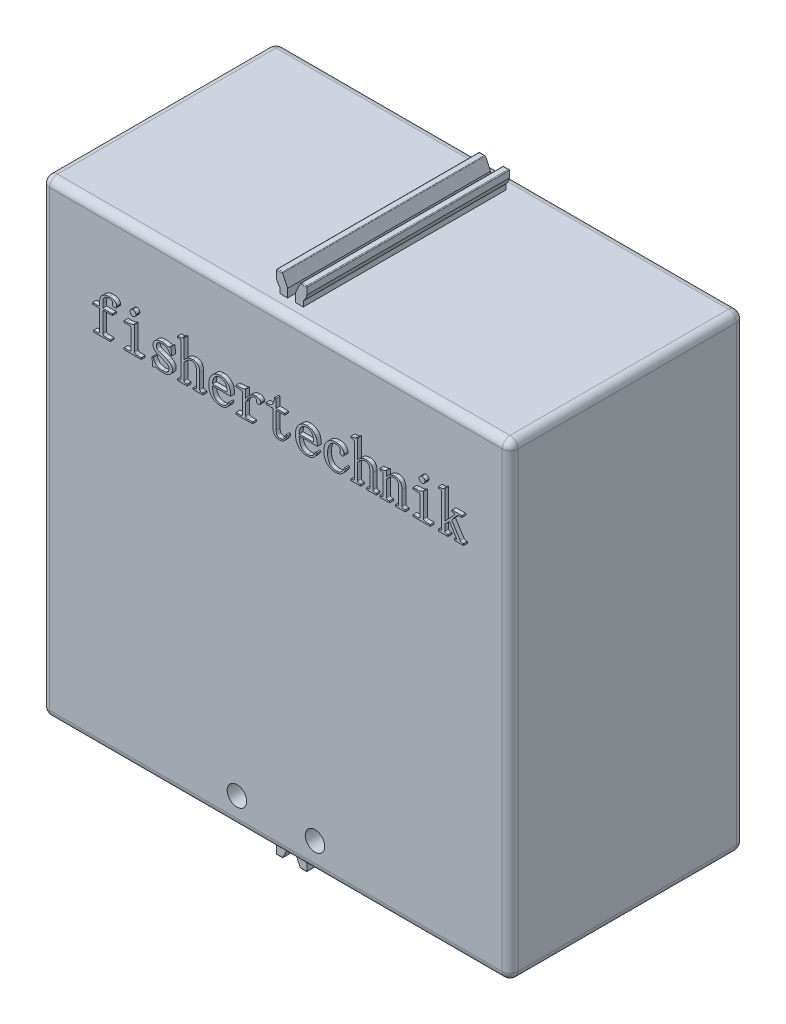
from build123d import *

# Parameters (mm, degrees)
SKETCH_1_W          = 60
SKETCH_1_H          = 60
EXTRUDE_1_DEPTH     = 30
EXTRUDE_START       = -2
EXTRUDE_2_DEPTH     = 26
SKETCH_3_R          = 1.25
CUT_EXTRUDE_1_DEPTH = 5
FILLET_1_R          = 1
FILLET_2_R          = 0.1
EXTRUDE_3_DEPTH     = 0.5


with BuildPart() as part:
    # 草图1 → 凸台-拉伸1 (new body)
    with BuildSketch(Plane.XY):
        with Locations((0, 30)):
            Rectangle(SKETCH_1_W, SKETCH_1_H)
    extrude(amount=-EXTRUDE_1_DEPTH)

    # 草图2 → 凸台-拉伸2 (add)
    with BuildSketch(Plane.XY.offset(EXTRUDE_START)):
        with BuildLine():
            Line((-1.5, 60), (-0.5, 60))
            Line((-0.5, 60), (-0.5, 61.07225346))
            Line((-0.5, 61.07225346), (-1.165769145, 62.5))
            Line((-1.165769145, 62.5), (-1.95, 62.5))
            Line((-1.95, 62.5), (-1.95, 61.555590279))
            ThreePointArc((-1.95, 61.555590279), (-1.780042303, 61.088161527), (-1.5, 60.677124344))
            Line((-1.5, 60.677124344), (-1.5, 60))
        make_face()
        with BuildLine():
            Line((0.5, 61.07225346), (1.165769145, 62.5))
            Line((1.165769145, 62.5), (1.95, 62.5))
            Line((1.95, 62.5), (1.95, 61.555590279))
            ThreePointArc((1.95, 61.555590279), (1.780042303, 61.088161527), (1.5, 60.677124344))
            Line((1.5, 60.677124344), (1.5, 60))
            Line((1.5, 60), (0.5, 60))
            Line((0.5, 60), (0.5, 61.07225346))
        make_face()
        with BuildLine():
            Line((0.5, 0), (1.5, 0))
            Line((1.5, 0), (1.5, -0.677124344))
            ThreePointArc((1.5, -0.677124344), (1.780042303, -1.088161527), (1.95, -1.555590279))
            Line((1.95, -1.555590279), (1.95, -2.5))
            Line((1.95, -2.5), (1.165769145, -2.5))
            Line((1.165769145, -2.5), (0.5, -1.07225346))
            Line((0.5, -1.07225346), (0.5, 0))
        make_face()
        with BuildLine():
            Line((-0.5, 0), (-0.5, -1.07225346))
            Line((-0.5, -1.07225346), (-1.165769145, -2.5))
            Line((-1.165769145, -2.5), (-1.95, -2.5))
            Line((-1.95, -2.5), (-1.95, -1.555590279))
            ThreePointArc((-1.95, -1.555590279), (-1.780042303, -1.088161527), (-1.5, -0.677124344))
            Line((-1.5, -0.677124344), (-1.5, 0))
            Line((-1.5, 0), (-0.5, 0))
        make_face()
    extrude(amount=-EXTRUDE_2_DEPTH)

    # 草图3 → 切除-拉伸1 (cut)
    with BuildSketch(Plane.XY):
        with Locations((-5, 3.5)):
            Circle(SKETCH_3_R)
        with Locations((5, 3.5)):
            Circle(SKETCH_3_R)
    extrude(amount=-CUT_EXTRUDE_1_DEPTH, mode=Mode.SUBTRACT)

    # 圆角1
    fillet_1_edges = [part.edges().sort_by_distance(p)[0] for p in [
        (30, 30, -30),
        (0, 60, -30),
        (-30, 30, -30),
        (0, 60, 0),
        (30, 30, 0),
        (0, 0, 0),
        (-30, 30, 0),
        (0, 0, -30),
        (-30, 60, -15),
        (30, 60, -15),
        (30, 0, -15),
        (-30, 0, -15),
    ]]
    fillet(fillet_1_edges, radius=FILLET_1_R)

    # 圆角2
    fillet_2_edges = [part.edges().sort_by_distance(p)[0] for p in [
        (-1.557884573, 62.5, -28),
        (-1.95, 62.5, -15),
        (-1.165769145, 62.5, -15),
        (-1.557884573, 62.5, -2),
        (1.557884573, 62.5, -28),
        (1.165769145, 62.5, -15),
        (1.95, 62.5, -15),
        (1.557884573, 62.5, -2),
        (1.557884573, -2.5, -28),
        (1.95, -2.5, -15),
        (1.165769145, -2.5, -15),
        (1.557884573, -2.5, -2),
        (-1.557884573, -2.5, -28),
        (-1.165769145, -2.5, -15),
        (-1.95, -2.5, -15),
        (-1.557884573, -2.5, -2),
    ]]
    fillet(fillet_2_edges, radius=FILLET_2_R)

    # 草图5 → 凸台-拉伸3 (add)
    # profile 1 of 15: a face of its own
    with BuildSketch(Plane.XY):
        with BuildLine():
            add(Edge.make_bspline(
                [(-22.108281673, 50.011390736), (-22.10753709, 50.060765805), (-22.106090926, 50.15666436), (-22.086785216, 50.295355007), (-22.058815279, 50.425388258), (-22.0167077, 50.545248592), (-21.96421533, 50.656076354), (-21.898944175, 50.756567634), (-21.823107135, 50.848516275), (-21.734112031, 50.928101243), (-21.639464143, 50.999321109), (-21.540778581, 51.06154761), (-21.439736286, 51.114361482), (-21.336186603, 51.157638083), (-21.229633971, 51.191138303), (-21.120090915, 51.214049847), (-21.008378304, 51.23034596), (-20.9329254, 51.231566102), (-20.894995601, 51.232179461)],
                knots=[0, 0, 0, 0, 1.224224021, 2.377744784, 3.468185473, 4.519582647, 5.522780811, 6.503957574, 7.485814974, 8.470988726, 9.458592698, 10.422760435, 11.362531626, 12.284530258, 13.204224423, 14.129286746, 15.059601779, 16, 16, 16, 16], degree=3))
            add(Edge.make_bspline(
                [(-20.894995601, 51.232179461), (-20.855330317, 51.2313943), (-20.778430673, 51.229872096), (-20.6670629, 51.222978202), (-20.563143123, 51.209157882), (-20.467391449, 51.188520588), (-20.378429181, 51.1645748), (-20.297875092, 51.133172497), (-20.224422156, 51.096934823), (-20.140098121, 51.042662949), (-20.051449434, 50.96769295), (-19.972108407, 50.865923462), (-19.92135856, 50.754570424), (-19.915933236, 50.676413723), (-19.913219945, 50.637326307)],
                knots=[0, 0, 0, 0, 1.123326941, 2.177809744, 3.157845171, 4.088386108, 4.949942037, 5.763413807, 6.53252398, 7.26496582, 8.599253069, 9.797092605, 10.898290788, 12, 12, 12, 12], degree=3))
            add(Edge.make_bspline(
                [(-19.913219945, 50.637326307), (-19.91370959, 50.6179803), (-19.914660876, 50.580394702), (-19.925792451, 50.525824381), (-19.944092942, 50.475229173), (-19.96925429, 50.42809591), (-20.006780335, 50.387313132), (-20.059935423, 50.359627068), (-20.126158304, 50.34239712), (-20.1749688, 50.341126971), (-20.201536158, 50.340435634)],
                knots=[0, 0, 0, 0, 0.974927748, 1.894098443, 2.795058864, 3.682757122, 4.575383525, 5.543622152, 6.663003352, 8, 8, 8, 8], degree=3))
            add(Edge.make_bspline(
                [(-20.201536158, 50.340435634), (-20.219797339, 50.340962513), (-20.255234463, 50.34198496), (-20.30587501, 50.352377601), (-20.350618156, 50.371622865), (-20.391593654, 50.395162636), (-20.423972208, 50.431451324), (-20.44610947, 50.477871223), (-20.460482522, 50.534310488), (-20.461457527, 50.575415754), (-20.461985377, 50.59766943)],
                knots=[0, 0, 0, 0, 1.042632251, 2.0233022, 2.929126597, 3.818243783, 4.699597659, 5.657927911, 6.73204292, 8, 8, 8, 8], degree=3))
            add(Edge.make_bspline(
                [(-20.461985377, 50.59766943), (-20.461217834, 50.60986176), (-20.459391709, 50.638869546), (-20.448241981, 50.683896652), (-20.435557979, 50.72820803), (-20.433773103, 50.757311973), (-20.433046575, 50.769158628)],
                knots=[0, 0, 0, 0, 0.839592585, 1.997544458, 3.184907679, 4, 4, 4, 4], degree=3))
            add(Edge.make_bspline(
                [(-20.433046575, 50.769158628), (-20.434041377, 50.787477778), (-20.435975449, 50.823093447), (-20.452109384, 50.874113311), (-20.48193762, 50.917426808), (-20.520500845, 50.959603682), (-20.583579979, 50.991720071), (-20.671723987, 51.011365861), (-20.787401576, 51.025061634), (-20.87386347, 51.025917823), (-20.921790788, 51.026392424)],
                knots=[0, 0, 0, 0, 0.702599087, 1.365976878, 2.020080191, 2.708489356, 3.536825578, 4.684110467, 6.161945327, 8, 8, 8, 8], degree=3))
            add(Edge.make_bspline(
                [(-20.921790788, 51.026392424), (-20.94968048, 51.025765368), (-21.00455962, 51.024531497), (-21.085054364, 51.015098878), (-21.161403544, 50.997713808), (-21.233633011, 50.974236051), (-21.30173989, 50.943818675), (-21.36615915, 50.907469133), (-21.426810029, 50.864331233), (-21.482682744, 50.813746007), (-21.533916271, 50.755363999), (-21.578184864, 50.687272205), (-21.613791675, 50.609126345), (-21.645554799, 50.523089092), (-21.668811316, 50.427052791), (-21.683894923, 50.321505417), (-21.695428072, 50.20706569), (-21.696271521, 50.127535657), (-21.696707599, 50.08641726)],
                knots=[0, 0, 0, 0, 0.96181058, 1.892575153, 2.789361416, 3.658288213, 4.507777425, 5.357534686, 6.205503358, 7.069172381, 7.951278624, 8.877464566, 9.858576571, 10.907088159, 12.036735332, 13.258334219, 14.582511559, 16, 16, 16, 16], degree=3))
            Line((-21.696707599, 50.08641726), (-21.696707599, 49.517287486))
            Line((-21.696707599, 49.517287486), (-20.461985377, 49.517287486))
            Line((-20.461985377, 49.517287486), (-20.461985377, 49.311500449))
            Line((-20.461985377, 49.311500449), (-21.696707599, 49.311500449))
            Line((-21.696707599, 49.311500449), (-21.696707599, 46.724157181))
            add(Edge.make_bspline(
                [(-21.696707599, 46.724157181), (-21.696070452, 46.706541323), (-21.694851119, 46.672829167), (-21.680536209, 46.625922092), (-21.65747892, 46.585494806), (-21.624563997, 46.55313486), (-21.584630887, 46.528803088), (-21.539215692, 46.511388803), (-21.488934401, 46.500516698), (-21.453464595, 46.499567), (-21.435186573, 46.499077609)],
                knots=[0, 0, 0, 0, 1.07782116, 2.062668602, 2.976378416, 3.906510516, 4.861627316, 5.826507063, 6.879972634, 8, 8, 8, 8], degree=3))
            Line((-21.435186573, 46.499077609), (-20.736368093, 46.499077609))
            Line((-20.736368093, 46.499077609), (-20.736368093, 46.293290572))
            Line((-20.736368093, 46.293290572), (-22.862834142, 46.293290572))
            Line((-22.862834142, 46.293290572), (-22.862834142, 46.499077609))
            Line((-22.862834142, 46.499077609), (-22.369802699, 46.499077609))
            add(Edge.make_bspline(
                [(-22.369802699, 46.499077609), (-22.347235917, 46.499477611), (-22.305371276, 46.500219671), (-22.248266287, 46.510847275), (-22.20127693, 46.527319904), (-22.165001436, 46.553123911), (-22.138791686, 46.586572783), (-22.120177314, 46.626488245), (-22.109654465, 46.673244659), (-22.108755166, 46.70659681), (-22.108281673, 46.724157181)],
                knots=[0, 0, 0, 0, 1.353357623, 2.510673856, 3.475070896, 4.320672722, 5.14504497, 5.999314305, 6.946611178, 8, 8, 8, 8], degree=3))
            Line((-22.108281673, 46.724157181), (-22.108281673, 49.311500449))
            Line((-22.108281673, 49.311500449), (-23.0000255, 49.311500449))
            Line((-23.0000255, 49.311500449), (-23.0000255, 49.517287486))
            Line((-23.0000255, 49.517287486), (-22.108281673, 49.517287486))
            Line((-22.108281673, 49.517287486), (-22.108281673, 50.011390736))
        make_face()
    # profile 2 of 15: a face of its own
    with BuildSketch(Plane.XY):
        with BuildLine():
            add(Edge.make_bspline(
                [(-18.061136611, 49.058553882), (-18.061478662, 49.076509402), (-18.062137054, 49.111070824), (-18.074859911, 49.159727578), (-18.092615535, 49.203990514), (-18.120120926, 49.242125184), (-18.156350797, 49.27460749), (-18.204498952, 49.297331191), (-18.263470246, 49.309405547), (-18.306166275, 49.310768644), (-18.329088483, 49.311500449)],
                knots=[0, 0, 0, 0, 1.016752352, 1.9570811, 2.839309094, 3.712382418, 4.604133222, 5.575498547, 6.698358436, 8, 8, 8, 8], degree=3))
            Line((-18.329088483, 49.311500449), (-18.952880439, 49.311500449))
            Line((-18.952880439, 49.311500449), (-18.952880439, 49.517287486))
            Line((-18.952880439, 49.517287486), (-18.657061573, 49.517287486))
            add(Edge.make_bspline(
                [(-18.657061573, 49.517287486), (-18.570505021, 49.51921345), (-18.401719171, 49.522969093), (-18.194343302, 49.550847025), (-18.036668799, 49.586255323), (-17.923331339, 49.621905243), (-17.813353188, 49.666662844), (-17.743569799, 49.704211028), (-17.708511949, 49.723074523)],
                knots=[0, 0, 0, 0, 1.586728897, 3.094131884, 3.826747391, 4.547789585, 5.27043707, 6, 6, 6, 6], degree=3))
            Line((-17.708511949, 49.723074523), (-17.649562537, 49.723074523))
            Line((-17.649562537, 49.723074523), (-17.649562537, 46.727372603))
            add(Edge.make_bspline(
                [(-17.649562537, 46.727372603), (-17.648946625, 46.709402898), (-17.647779112, 46.675339853), (-17.633348893, 46.627519248), (-17.60943177, 46.587063262), (-17.576284375, 46.553754109), (-17.535004208, 46.530183929), (-17.489114427, 46.511045224), (-17.437095555, 46.500552722), (-17.400588766, 46.499582158), (-17.381610666, 46.499077609)],
                knots=[0, 0, 0, 0, 1.077549181, 2.042582623, 2.967322301, 3.878741212, 4.832954204, 5.806320395, 6.859612949, 8, 8, 8, 8], degree=3))
            Line((-17.381610666, 46.499077609), (-16.75781871, 46.499077609))
            Line((-16.75781871, 46.499077609), (-16.75781871, 46.293290572))
            Line((-16.75781871, 46.293290572), (-18.952880439, 46.293290572))
            Line((-18.952880439, 46.293290572), (-18.952880439, 46.499077609))
            Line((-18.952880439, 46.499077609), (-18.329088483, 46.499077609))
            add(Edge.make_bspline(
                [(-18.329088483, 46.499077609), (-18.306164471, 46.499478732), (-18.263591041, 46.500223678), (-18.205444672, 46.510871311), (-18.157395749, 46.527313096), (-18.120173428, 46.553103884), (-18.092535405, 46.586197877), (-18.074452559, 46.626690131), (-18.062107739, 46.673051766), (-18.061471008, 46.706559606), (-18.061136611, 46.724157181)],
                knots=[0, 0, 0, 0, 1.358022442, 2.522057431, 3.494527888, 4.347116691, 5.174840196, 6.0186897, 6.959459742, 8, 8, 8, 8], degree=3))
            Line((-18.061136611, 46.724157181), (-18.061136611, 49.058553882))
        make_face()
    # profile 3 of 15: a face of its own
    with BuildSketch(Plane.XY):
        with BuildLine():
            add(Edge.make_bspline(
                [(-17.821051735, 51.30077514), (-17.79730602, 51.299688588), (-17.750325605, 51.297538866), (-17.682404047, 51.275573439), (-17.618286289, 51.241791156), (-17.559246566, 51.196101558), (-17.508002258, 51.141806198), (-17.470502022, 51.079383493), (-17.448004259, 51.010742512), (-17.445207525, 50.962966949), (-17.4437755, 50.93850421)],
                knots=[0, 0, 0, 0, 0.983606346, 1.946045221, 2.935234574, 3.983141566, 5.033463213, 6.018524185, 6.985415912, 8, 8, 8, 8], degree=3))
            add(Edge.make_bspline(
                [(-17.4437755, 50.93850421), (-17.445251735, 50.913691001), (-17.448175536, 50.864546438), (-17.470869911, 50.79298469), (-17.507942322, 50.725593261), (-17.559034518, 50.665168592), (-17.617508161, 50.613027563), (-17.681744639, 50.574578019), (-17.750058697, 50.550369538), (-17.797278707, 50.547611308), (-17.821051735, 50.546222671)],
                knots=[0, 0, 0, 0, 0.993969176, 1.968636141, 2.982046597, 4.061031328, 5.127474309, 6.110639151, 7.04879673, 8, 8, 8, 8], degree=3))
            add(Edge.make_bspline(
                [(-17.821051735, 50.546222671), (-17.844832075, 50.547597735), (-17.892066608, 50.550329005), (-17.960564475, 50.574845725), (-18.025474658, 50.612700614), (-18.084187166, 50.664864546), (-18.134067196, 50.725954189), (-18.171284333, 50.792944461), (-18.193915158, 50.864556561), (-18.196847449, 50.913694397), (-18.19832797, 50.93850421)],
                knots=[0, 0, 0, 0, 0.950814332, 1.888588308, 2.883699067, 3.949705989, 5.019172734, 6.032168815, 7.006437249, 8, 8, 8, 8], degree=3))
            add(Edge.make_bspline(
                [(-18.19832797, 50.93850421), (-18.196891788, 50.962963255), (-18.194086936, 51.010731602), (-18.171648229, 51.079425073), (-18.134042578, 51.141434836), (-18.083941219, 51.196414546), (-18.024659072, 51.242087904), (-17.959931103, 51.275319973), (-17.891796242, 51.29757793), (-17.84480362, 51.299701703), (-17.821051735, 51.30077514)],
                knots=[0, 0, 0, 0, 1.014184414, 1.980695254, 2.965368182, 4.005270207, 5.052764397, 6.054721383, 7.016781125, 8, 8, 8, 8], degree=3))
        make_face()
    # profile 4 of 15: a face of its own
    with BuildSketch(Plane.XY):
        with BuildLine():
            add(Edge.make_bspline(
                [(-15.248713772, 48.679134033), (-15.247774985, 48.71493211), (-15.245952947, 48.784410587), (-15.229186249, 48.885414345), (-15.203091673, 48.980024544), (-15.164389899, 49.067643824), (-15.118030207, 49.150297432), (-15.057310413, 49.22404477), (-14.989073444, 49.294069277), (-14.90801526, 49.353455533), (-14.821672549, 49.408580799), (-14.729237112, 49.454980275), (-14.633619587, 49.496303954), (-14.533705707, 49.529819606), (-14.429094658, 49.553941749), (-14.320641967, 49.57200534), (-14.207928911, 49.584694355), (-14.131211702, 49.585482651), (-14.092233496, 49.585883165)],
                knots=[0, 0, 0, 0, 1.041161132, 2.020731114, 2.972020257, 3.889577052, 4.802763098, 5.720319893, 6.661495641, 7.641065624, 8.636404346, 9.640934831, 10.647239869, 11.666623018, 12.703256548, 13.768290617, 14.866121075, 16, 16, 16, 16], degree=3))
            add(Edge.make_bspline(
                [(-14.092233496, 49.585883165), (-14.048601221, 49.585191162), (-13.962179386, 49.583820521), (-13.834414936, 49.568876943), (-13.709763547, 49.547512237), (-13.592891082, 49.514159248), (-13.486810948, 49.482827271), (-13.395635428, 49.460575937), (-13.323206562, 49.444686397), (-13.280568146, 49.442223774), (-13.262654503, 49.441189154)],
                knots=[0, 0, 0, 0, 1.23830651, 2.452696328, 3.648598213, 4.824847231, 5.900605646, 6.788823358, 7.491149342, 8, 8, 8, 8], degree=3))
            add(Edge.make_bspline(
                [(-13.262654503, 49.441189154), (-13.23536401, 49.442468579), (-13.184779139, 49.444840083), (-13.123935168, 49.463356486), (-13.08117358, 49.489278992), (-13.046302195, 49.515039821), (-13.007294858, 49.54762034), (-12.980982095, 49.572504672), (-12.966835637, 49.585883165)],
                knots=[0, 0, 0, 0, 1.443492635, 2.675616289, 3.311394778, 4.083139603, 4.969443738, 6, 6, 6, 6], degree=3))
            Line((-12.966835637, 49.585883165), (-12.847865007, 48.653410653))
            Line((-12.847865007, 48.653410653), (-13.020426012, 48.625543659))
            add(Edge.make_bspline(
                [(-13.020426012, 48.625543659), (-13.041137172, 48.681747076), (-13.081612678, 48.791584559), (-13.171846237, 48.939896709), (-13.279844006, 49.070809985), (-13.407771008, 49.180442516), (-13.548628453, 49.269899749), (-13.701028402, 49.334102554), (-13.862741186, 49.372709578), (-13.973768132, 49.377610782), (-14.030068662, 49.380096128)],
                knots=[0, 0, 0, 0, 1.063211706, 2.077818446, 3.070436531, 4.070552296, 5.061399174, 6.026815371, 6.999420017, 8, 8, 8, 8], degree=3))
            add(Edge.make_bspline(
                [(-14.030068662, 49.380096128), (-14.089486877, 49.378730889), (-14.20221606, 49.376140738), (-14.361726449, 49.349378884), (-14.501523781, 49.304901567), (-14.621077615, 49.243253613), (-14.717652476, 49.164761071), (-14.788089455, 49.070086357), (-14.829541486, 48.959189368), (-14.834545712, 48.880628091), (-14.837139698, 48.839905155)],
                knots=[0, 0, 0, 0, 1.308989817, 2.4834363, 3.551980132, 4.53143708, 5.431995853, 6.271666847, 7.104103161, 8, 8, 8, 8], degree=3))
            add(Edge.make_bspline(
                [(-14.837139698, 48.839905155), (-14.83592044, 48.804104822), (-14.833598407, 48.735924379), (-14.815879507, 48.639483655), (-14.784575196, 48.555159493), (-14.740149511, 48.481600032), (-14.676609962, 48.420174448), (-14.59448616, 48.370726026), (-14.4941632, 48.328347584), (-14.419479104, 48.309701256), (-14.379477902, 48.299714183)],
                knots=[0, 0, 0, 0, 1.093455234, 2.082446053, 2.980526035, 3.828595193, 4.685329752, 5.651408359, 6.742081746, 8, 8, 8, 8], degree=3))
            add(Edge.make_bspline(
                [(-14.379477902, 48.299714183), (-14.344221302, 48.284429941), (-14.269938836, 48.252227425), (-14.150538924, 48.207346319), (-14.020054047, 48.157013664), (-13.830901765, 48.092222738), (-13.59441978, 48.009528105), (-13.411545277, 47.929280695), (-13.322675722, 47.890283724)],
                knots=[0, 0, 0, 0, 0.610018673, 1.285254125, 2.024850497, 2.830357692, 4.459683037, 6, 6, 6, 6], degree=3))
            add(Edge.make_bspline(
                [(-13.322675722, 47.890283724), (-13.285867974, 47.869826727), (-13.212747548, 47.829187885), (-13.110459297, 47.757805099), (-13.01925032, 47.674665712), (-12.935430219, 47.58655199), (-12.866204141, 47.489377214), (-12.816034906, 47.384770382), (-12.784402311, 47.274041174), (-12.780988887, 47.197745842), (-12.779269328, 47.15931102)],
                knots=[0, 0, 0, 0, 1.054931048, 2.095673068, 3.116470365, 4.142710073, 5.138708902, 6.09173417, 7.038684852, 8, 8, 8, 8], degree=3))
            add(Edge.make_bspline(
                [(-12.779269328, 47.15931102), (-12.780463013, 47.123906955), (-12.782799429, 47.054610158), (-12.796281572, 46.953064657), (-12.821496339, 46.857785639), (-12.854091679, 46.76759012), (-12.899044009, 46.684562042), (-12.952530479, 46.606864865), (-13.016788918, 46.535811593), (-13.089497916, 46.469983902), (-13.172464354, 46.41262649), (-13.263413986, 46.361591262), (-13.363531003, 46.318469413), (-13.473167929, 46.285370834), (-13.590661828, 46.256594832), (-13.717297968, 46.237875356), (-13.852688509, 46.227550335), (-13.945735061, 46.225665196), (-13.993627208, 46.224694893)],
                knots=[0, 0, 0, 0, 0.979243257, 1.916684526, 2.82477802, 3.700037933, 4.561814218, 5.427770342, 6.302305217, 7.204739074, 8.133814832, 9.0846931, 10.084792015, 11.140848933, 12.247842653, 13.427020097, 14.6756572, 16, 16, 16, 16], degree=3))
            add(Edge.make_bspline(
                [(-13.993627208, 46.224694893), (-14.053688171, 46.225267315), (-14.166136629, 46.226339025), (-14.32294928, 46.240448528), (-14.456455126, 46.261153726), (-14.567074508, 46.293544784), (-14.658869743, 46.328801302), (-14.741749229, 46.351178687), (-14.814777293, 46.366510541), (-14.861016265, 46.368485843), (-14.882155612, 46.369388904)],
                knots=[0, 0, 0, 0, 1.591451246, 2.979576551, 4.170607508, 5.165749067, 6.028321082, 6.775030151, 7.439973203, 8, 8, 8, 8], degree=3))
            add(Edge.make_bspline(
                [(-14.882155612, 46.369388904), (-14.913164915, 46.367202174), (-14.979624832, 46.362515519), (-15.078858821, 46.324776856), (-15.185747446, 46.278804495), (-15.258842034, 46.24323613), (-15.296945109, 46.224694893)],
                knots=[0, 0, 0, 0, 0.838653413, 1.797423076, 2.851830802, 4, 4, 4, 4], degree=3))
            Line((-15.296945109, 46.224694893), (-15.38590513, 47.293286955))
            Line((-15.38590513, 47.293286955), (-15.212272318, 47.322225757))
            add(Edge.make_bspline(
                [(-15.212272318, 47.322225757), (-15.204636522, 47.285995713), (-15.189749277, 47.215359259), (-15.158141875, 47.114042232), (-15.121029053, 47.01955147), (-15.076753403, 46.93206888), (-15.026429761, 46.851788058), (-14.970331077, 46.777671361), (-14.907031509, 46.71161563), (-14.837628476, 46.651702213), (-14.761469486, 46.599191889), (-14.677951926, 46.554031454), (-14.587703971, 46.515134596), (-14.489482393, 46.484571389), (-14.384267594, 46.459564984), (-14.271623508, 46.443251602), (-14.152131911, 46.431847537), (-14.070112263, 46.430945762), (-14.027925047, 46.43048193)],
                knots=[0, 0, 0, 0, 1.084119902, 2.113670811, 3.104843823, 4.054997298, 4.981334785, 5.877256755, 6.772995316, 7.656172719, 8.55903662, 9.476999928, 10.433472893, 11.433064244, 12.486593202, 13.598200158, 14.764622251, 16, 16, 16, 16], degree=3))
            add(Edge.make_bspline(
                [(-14.027925047, 46.43048193), (-13.964211973, 46.431766225), (-13.844358069, 46.434182177), (-13.67619001, 46.461301937), (-13.530480255, 46.503753074), (-13.426275305, 46.556764095), (-13.356329046, 46.607994527), (-13.312744407, 46.651198218), (-13.274163335, 46.697737804), (-13.243127348, 46.749363438), (-13.219164786, 46.805638642), (-13.203739581, 46.8668103), (-13.192243648, 46.931659506), (-13.191315694, 46.976691956), (-13.190843402, 46.999611704)],
                knots=[0, 0, 0, 0, 1.999833322, 3.761988201, 5.334787057, 6.750396353, 7.408108345, 8.051001393, 8.673283834, 9.302711662, 9.936427806, 10.587111421, 11.280895187, 12, 12, 12, 12], degree=3))
            add(Edge.make_bspline(
                [(-13.190843402, 46.999611704), (-13.192291344, 47.031176828), (-13.195107755, 47.092574543), (-13.216609044, 47.179894623), (-13.252648325, 47.258837253), (-13.303865966, 47.325871386), (-13.359998285, 47.38464301), (-13.417175032, 47.43583374), (-13.474725186, 47.477804174), (-13.514664819, 47.500147119), (-13.533821797, 47.510863875)],
                knots=[0, 0, 0, 0, 1.166614483, 2.269196342, 3.303874456, 4.353217701, 5.372163199, 6.308302233, 7.188580014, 8, 8, 8, 8], degree=3))
            add(Edge.make_bspline(
                [(-13.533821797, 47.510863875), (-13.633736527, 47.551184992), (-13.842739305, 47.635529167), (-14.108931553, 47.737051001), (-14.325912526, 47.822161103), (-14.48132987, 47.885415401), (-14.626136387, 47.946289859), (-14.718587948, 47.987318995), (-14.763184981, 48.00711074)],
                knots=[0, 0, 0, 0, 1.462690102, 3.05967191, 3.867586568, 4.626865783, 5.337623807, 6, 6, 6, 6], degree=3))
            add(Edge.make_bspline(
                [(-14.763184981, 48.00711074), (-14.803771132, 48.026806694), (-14.881397881, 48.06447799), (-14.983943057, 48.13479795), (-15.069361108, 48.211427215), (-15.137040997, 48.295731454), (-15.185976895, 48.386926554), (-15.221886673, 48.480899901), (-15.244323295, 48.578771577), (-15.247239515, 48.645433806), (-15.248713772, 48.679134033)],
                knots=[0, 0, 0, 0, 1.228073327, 2.348863842, 3.375854558, 4.346023554, 5.278522889, 6.184516841, 7.08220598, 8, 8, 8, 8], degree=3))
        make_face()
    # profile 5 of 15: a face of its own
    with BuildSketch(Plane.XY):
        with BuildLine():
            Line((-12.093312537, 46.293290572), (-12.093312537, 46.499077609))
            Line((-12.093312537, 46.499077609), (-11.946474912, 46.499077609))
            add(Edge.make_bspline(
                [(-11.946474912, 46.499077609), (-11.9239377, 46.499566252), (-11.881776672, 46.500480372), (-11.823850158, 46.510219281), (-11.776975654, 46.528952045), (-11.739631413, 46.553754757), (-11.712955671, 46.58789215), (-11.695250183, 46.628538942), (-11.682589606, 46.675538088), (-11.682033374, 46.709412549), (-11.681738463, 46.727372603)],
                knots=[0, 0, 0, 0, 1.33790291, 2.502854497, 3.463994568, 4.317254726, 5.132213027, 5.995955891, 6.937466725, 8, 8, 8, 8], degree=3))
            Line((-11.681738463, 46.727372603), (-11.681738463, 50.79809743))
            add(Edge.make_bspline(
                [(-11.681738463, 50.79809743), (-11.682204398, 50.816015476), (-11.683090058, 50.850074477), (-11.693626753, 50.897389388), (-11.711223617, 50.937370018), (-11.734990286, 50.971230997), (-11.769456908, 50.996878789), (-11.813536912, 51.014868519), (-11.867771729, 51.025114679), (-11.907129559, 51.025946148), (-11.928254185, 51.026392424)],
                knots=[0, 0, 0, 0, 1.103482294, 2.097522442, 2.965404873, 3.784969269, 4.61775093, 5.57523381, 6.698549209, 8, 8, 8, 8], degree=3))
            Line((-11.928254185, 51.026392424), (-12.093312537, 51.026392424))
            Line((-12.093312537, 51.026392424), (-12.093312537, 51.232179461))
            Line((-12.093312537, 51.232179461), (-11.781416559, 51.232179461))
            add(Edge.make_bspline(
                [(-11.781416559, 51.232179461), (-11.743223231, 51.234743441), (-11.664950009, 51.239998051), (-11.549401203, 51.281990376), (-11.434110989, 51.347134063), (-11.363907757, 51.406651355), (-11.326970186, 51.437966498)],
                knots=[0, 0, 0, 0, 0.897059431, 1.838429268, 2.862685223, 4, 4, 4, 4], degree=3))
            Line((-11.326970186, 51.437966498), (-11.270164389, 51.437966498))
            Line((-11.270164389, 51.437966498), (-11.270164389, 49.008178931))
            add(Edge.make_bspline(
                [(-11.270164389, 49.008178931), (-11.22828939, 49.058053467), (-11.14786555, 49.153840971), (-11.015927513, 49.277197736), (-10.88449983, 49.380130279), (-10.747757841, 49.457490103), (-10.607757568, 49.513918285), (-10.464238151, 49.557336747), (-10.314496393, 49.580334481), (-10.213072627, 49.584022808), (-10.16191545, 49.585883165)],
                knots=[0, 0, 0, 0, 1.203763451, 2.311911181, 3.3351186, 4.285292674, 5.207088562, 6.123179625, 7.05334975, 8, 8, 8, 8], degree=3))
            add(Edge.make_bspline(
                [(-10.16191545, 49.585883165), (-10.127239072, 49.584914423), (-10.060218228, 49.583042084), (-9.962512118, 49.572755204), (-9.87111732, 49.55312959), (-9.785444821, 49.526880584), (-9.706343802, 49.492300805), (-9.63387701, 49.449992833), (-9.567043206, 49.400737514), (-9.50677529, 49.343367501), (-9.4521039, 49.278618268), (-9.406500234, 49.204193555), (-9.367810288, 49.121742793), (-9.335252816, 49.031084908), (-9.311543617, 48.931389729), (-9.293032956, 48.823689106), (-9.282371121, 48.707574054), (-9.281394493, 48.627351697), (-9.280889698, 48.585886782)],
                knots=[0, 0, 0, 0, 1.090580602, 2.107821975, 3.083848908, 4.025392113, 4.920770314, 5.791642309, 6.658884143, 7.525033961, 8.402402398, 9.31571157, 10.26039917, 11.262391683, 12.338587045, 13.478059084, 14.696472289, 16, 16, 16, 16], degree=3))
            Line((-9.280889698, 48.585886782), (-9.280889698, 46.727372603))
            add(Edge.make_bspline(
                [(-9.280889698, 46.727372603), (-9.280303955, 46.709384558), (-9.279193632, 46.675286747), (-9.264427933, 46.627875914), (-9.242025492, 46.586719988), (-9.208728869, 46.554169603), (-9.168334462, 46.529858779), (-9.12254336, 46.51110668), (-9.070930495, 46.50060621), (-9.034776535, 46.499597306), (-9.016153249, 46.499077609)],
                knots=[0, 0, 0, 0, 1.084401508, 2.055571771, 2.975330847, 3.892545633, 4.834398141, 5.813954141, 6.873944771, 8, 8, 8, 8], degree=3))
            Line((-9.016153249, 46.499077609), (-8.869315624, 46.499077609))
            Line((-8.869315624, 46.499077609), (-8.869315624, 46.293290572))
            Line((-8.869315624, 46.293290572), (-10.104037846, 46.293290572))
            Line((-10.104037846, 46.293290572), (-10.104037846, 46.499077609))
            Line((-10.104037846, 46.499077609), (-9.957200221, 46.499077609))
            add(Edge.make_bspline(
                [(-9.957200221, 46.499077609), (-9.934611268, 46.499366617), (-9.892285089, 46.499908147), (-9.83503968, 46.512036413), (-9.787121799, 46.528498995), (-9.75028676, 46.555031958), (-9.723968265, 46.58985433), (-9.705722634, 46.630963358), (-9.693374479, 46.678791027), (-9.69277914, 46.713351956), (-9.692463772, 46.731659833)],
                knots=[0, 0, 0, 0, 1.326789907, 2.486080109, 3.431545105, 4.289919765, 5.114640101, 5.971208469, 6.925293134, 8, 8, 8, 8], degree=3))
            Line((-9.692463772, 46.731659833), (-9.692463772, 48.565522439))
            add(Edge.make_bspline(
                [(-9.692463772, 48.565522439), (-9.692729214, 48.604837892), (-9.693238923, 48.680332695), (-9.701093108, 48.788332119), (-9.712219883, 48.886161489), (-9.729005348, 48.973383408), (-9.75164474, 49.05007334), (-9.778048373, 49.116708425), (-9.80865737, 49.173816097), (-9.858002255, 49.233472995), (-9.928889977, 49.292991765), (-10.026729321, 49.344662377), (-10.137577718, 49.375423023), (-10.215662376, 49.37849826), (-10.256234509, 49.380096128)],
                knots=[0, 0, 0, 0, 1.244376572, 2.389492093, 3.426253224, 4.360118045, 5.197564183, 5.953687352, 6.627122048, 7.238315643, 8.393995697, 9.532388368, 10.717849718, 12, 12, 12, 12], degree=3))
            add(Edge.make_bspline(
                [(-10.256234509, 49.380096128), (-10.294621677, 49.37847783), (-10.374492044, 49.375110715), (-10.49561334, 49.344800183), (-10.622528029, 49.299280669), (-10.754052419, 49.235051995), (-10.887922416, 49.14904739), (-11.019080293, 49.036476183), (-11.149420057, 48.899898207), (-11.228705707, 48.795051624), (-11.270164389, 48.740227059)],
                knots=[0, 0, 0, 0, 0.740427084, 1.540571626, 2.398388227, 3.34276509, 4.361068266, 5.462857481, 6.673321242, 8, 8, 8, 8], degree=3))
            Line((-11.270164389, 48.740227059), (-11.270164389, 46.731659833))
            add(Edge.make_bspline(
                [(-11.270164389, 46.731659833), (-11.269557095, 46.713327006), (-11.268405142, 46.678552218), (-11.253988528, 46.63027159), (-11.231003215, 46.588746066), (-11.198059024, 46.555445136), (-11.158172825, 46.52935494), (-11.111364485, 46.512890387), (-11.060413083, 46.500117255), (-11.024095869, 46.499430578), (-11.005427941, 46.499077609)],
                knots=[0, 0, 0, 0, 1.096905878, 2.080675828, 2.992910952, 3.917908729, 4.863551931, 5.827254879, 6.883156299, 8, 8, 8, 8], degree=3))
            Line((-11.005427941, 46.499077609), (-10.858590315, 46.499077609))
            Line((-10.858590315, 46.499077609), (-10.858590315, 46.293290572))
            Line((-10.858590315, 46.293290572), (-12.093312537, 46.293290572))
        make_face()
    # profile 6 of 15: a face of its own
    with BuildSketch(Plane.XY):
        with BuildLine():
            add(Edge.make_bspline(
                [(-7.634593402, 47.939586868), (-7.634045539, 47.87416932), (-7.632987131, 47.747790207), (-7.617194936, 47.565710518), (-7.594604114, 47.397969086), (-7.561410686, 47.244893745), (-7.51918893, 47.106105436), (-7.466521455, 46.982271598), (-7.405608383, 46.872028545), (-7.333031551, 46.777372236), (-7.252860367, 46.695842477), (-7.168190197, 46.623887779), (-7.075717195, 46.565021737), (-6.97847417, 46.515024184), (-6.874401018, 46.47808637), (-6.765591533, 46.449412984), (-6.650428552, 46.433533916), (-6.571762712, 46.431511706), (-6.5317035, 46.43048193)],
                knots=[0, 0, 0, 0, 1.477645099, 2.854638853, 4.126431223, 5.29974369, 6.390027713, 7.399139401, 8.335356284, 9.228213092, 10.08452146, 10.9155325, 11.732824521, 12.555956261, 13.380827905, 14.222746091, 15.094964344, 16, 16, 16, 16], degree=3))
            add(Edge.make_bspline(
                [(-6.5317035, 46.43048193), (-6.471071179, 46.433057004), (-6.353003698, 46.438071368), (-6.183612542, 46.480066597), (-6.028060517, 46.547633651), (-5.891547386, 46.645435289), (-5.769288602, 46.759152433), (-5.666501978, 46.889549184), (-5.578419525, 47.030528172), (-5.536684101, 47.133226566), (-5.515630005, 47.185034399)],
                knots=[0, 0, 0, 0, 1.075254026, 2.093809578, 3.079292087, 4.068280212, 5.060112598, 6.034981988, 7.008715515, 8, 8, 8, 8], degree=3))
            Line((-5.515630005, 47.185034399), (-5.370935994, 47.128228603))
            add(Edge.make_bspline(
                [(-5.370935994, 47.128228603), (-5.388693881, 47.076130857), (-5.425315675, 46.968690546), (-5.512670687, 46.814606753), (-5.626808014, 46.663423508), (-5.740064103, 46.541169529), (-5.844220352, 46.449370846), (-5.931685002, 46.389077171), (-6.025976126, 46.338403866), (-6.126792861, 46.296475436), (-6.235036297, 46.264502065), (-6.349725922, 46.240960265), (-6.471325741, 46.226790461), (-6.554530424, 46.22540398), (-6.597083757, 46.224694893)],
                knots=[0, 0, 0, 0, 1.207704563, 2.490628945, 3.871166331, 5.365704428, 6.145076586, 6.918372063, 7.69489053, 8.494068971, 9.313929581, 10.171760296, 11.064984217, 12, 12, 12, 12], degree=3))
            add(Edge.make_bspline(
                [(-6.597083757, 46.224694893), (-6.651808474, 46.225811667), (-6.759154059, 46.228002281), (-6.916067608, 46.248669565), (-7.064890128, 46.283210579), (-7.206274157, 46.330215858), (-7.340015002, 46.391620973), (-7.46572538, 46.467290672), (-7.584515313, 46.555255291), (-7.693732418, 46.657689629), (-7.79385181, 46.771675945), (-7.879750956, 46.89955402), (-7.953196741, 47.038406466), (-8.011862886, 47.189677025), (-8.057785677, 47.351938881), (-8.090758888, 47.525862862), (-8.111624966, 47.711497003), (-8.113697689, 47.839493513), (-8.114763155, 47.905289029)],
                knots=[0, 0, 0, 0, 1.025366047, 2.011312669, 2.959962339, 3.885377027, 4.799283924, 5.712307155, 6.631083429, 7.56450759, 8.513866073, 9.468547354, 10.445079418, 11.452354541, 12.503740749, 13.601695906, 14.767172217, 16, 16, 16, 16], degree=3))
            add(Edge.make_bspline(
                [(-8.114763155, 47.905289029), (-8.113692828, 47.964307787), (-8.111584444, 48.080565951), (-8.090069951, 48.250665129), (-8.058843417, 48.413771459), (-8.012411037, 48.568326514), (-7.953211132, 48.715635517), (-7.88009903, 48.854554671), (-7.795102493, 48.986807921), (-7.696615499, 49.108867117), (-7.589938178, 49.220711984), (-7.475133629, 49.318141155), (-7.354970411, 49.400954259), (-7.228890305, 49.469619993), (-7.095645468, 49.52083993), (-6.957100838, 49.558521061), (-6.812578404, 49.581705592), (-6.714353057, 49.584478731), (-6.664607628, 49.585883165)],
                knots=[0, 0, 0, 0, 1.143832546, 2.253179783, 3.319714245, 4.360836202, 5.377138205, 6.393511042, 7.400419333, 8.420680419, 9.429992887, 10.393322424, 11.334909033, 12.255490684, 13.17018846, 14.09617617, 15.035823886, 16, 16, 16, 16], degree=3))
            add(Edge.make_bspline(
                [(-6.664607628, 49.585883165), (-6.619527308, 49.585043218), (-6.530056616, 49.583376181), (-6.398785485, 49.564359936), (-6.27199661, 49.535015125), (-6.149261974, 49.496280141), (-6.032093004, 49.442176361), (-5.918080208, 49.380042196), (-5.810379219, 49.303167577), (-5.705897057, 49.217437404), (-5.609538486, 49.11649148), (-5.526093611, 48.997770297), (-5.456874831, 48.861780729), (-5.400614473, 48.709400884), (-5.354903764, 48.540985827), (-5.325589702, 48.355195274), (-5.305507313, 48.152958656), (-5.303422908, 48.012524941), (-5.302340315, 47.939586868)],
                knots=[0, 0, 0, 0, 0.890890218, 1.768145501, 2.61647483, 3.463243512, 4.307562363, 5.164642867, 6.027035635, 6.919856703, 7.834412288, 8.777265167, 9.778926256, 10.843140873, 11.984526042, 13.223823959, 14.558117398, 16, 16, 16, 16], degree=3))
            Line((-5.302340315, 47.939586868), (-7.634593402, 47.939586868))
        make_face()
        with BuildLine():
            add(Edge.make_bspline(
                [(-5.782510068, 48.145373905), (-5.780682718, 48.194319907), (-5.777146599, 48.28903572), (-5.784333501, 48.426507304), (-5.797831319, 48.555099383), (-5.819517484, 48.675180308), (-5.852231494, 48.785715928), (-5.891327365, 48.887980179), (-5.941324936, 48.980145801), (-5.9977153, 49.064443613), (-6.062444006, 49.137924735), (-6.131252473, 49.203134813), (-6.205243841, 49.25813789), (-6.284830297, 49.302285495), (-6.368557904, 49.338324968), (-6.458352306, 49.36291825), (-6.553076365, 49.376567045), (-6.617762819, 49.378906072), (-6.650674131, 49.380096128)],
                knots=[0, 0, 0, 0, 1.370696381, 2.652445935, 3.849847149, 4.989670568, 6.062758705, 7.073227958, 8.048784666, 8.992064924, 9.906695489, 10.784199536, 11.642450906, 12.479933149, 13.327096217, 14.188605603, 15.078394908, 16, 16, 16, 16], degree=3))
            add(Edge.make_bspline(
                [(-6.650674131, 49.380096128), (-6.686097213, 49.379023632), (-6.755482036, 49.376922885), (-6.857242463, 49.361656251), (-6.954106761, 49.336162058), (-7.045616598, 49.299274131), (-7.132429125, 49.252814888), (-7.21387572, 49.195735151), (-7.290674066, 49.128465468), (-7.362008469, 49.051795727), (-7.426678951, 48.965790682), (-7.482268419, 48.871032065), (-7.529564265, 48.768697927), (-7.568106413, 48.658842304), (-7.59803494, 48.541547678), (-7.619292607, 48.416461336), (-7.632280478, 48.283555512), (-7.633809504, 48.192206493), (-7.634593402, 48.145373905)],
                knots=[0, 0, 0, 0, 0.957790418, 1.876068192, 2.776066887, 3.660632451, 4.538204455, 5.433470798, 6.344245217, 7.294549534, 8.260783072, 9.248423116, 10.260019334, 11.305160705, 12.392549128, 13.529917234, 14.733644135, 16, 16, 16, 16], degree=3))
            Line((-7.634593402, 48.145373905), (-5.782510068, 48.145373905))
        make_face(mode=Mode.SUBTRACT)
    # profile 7 of 15: a face of its own
    with BuildSketch(Plane.XY):
        with BuildLine():
            add(Edge.make_bspline(
                [(-3.381661303, 48.633046311), (-3.333098967, 48.70634285), (-3.239468393, 48.847662185), (-3.086083664, 49.039938662), (-2.925803854, 49.203500436), (-2.762052964, 49.341284483), (-2.593273952, 49.449689055), (-2.421771318, 49.528017002), (-2.247559147, 49.57731472), (-2.130094827, 49.5830449), (-2.071912557, 49.585883165)],
                knots=[0, 0, 0, 0, 1.249658641, 2.409403398, 3.490536406, 4.500517881, 5.445995846, 6.332552821, 7.174082278, 8, 8, 8, 8], degree=3))
            add(Edge.make_bspline(
                [(-2.071912557, 49.585883165), (-2.026098595, 49.584167672), (-1.939160344, 49.580912291), (-1.816165168, 49.558611426), (-1.710199421, 49.516159135), (-1.621705544, 49.458956099), (-1.550230387, 49.391900271), (-1.498822654, 49.316934744), (-1.46598918, 49.235826899), (-1.462660578, 49.17925367), (-1.460982291, 49.150729326)],
                knots=[0, 0, 0, 0, 1.318797802, 2.502598972, 3.577656605, 4.581662962, 5.519902622, 6.378398186, 7.182384885, 8, 8, 8, 8], degree=3))
            add(Edge.make_bspline(
                [(-1.460982291, 49.150729326), (-1.461571306, 49.12741239), (-1.462689105, 49.083162843), (-1.477432579, 49.020641312), (-1.499503516, 48.964962045), (-1.531833603, 48.917134657), (-1.573676487, 48.878683304), (-1.62398872, 48.850009526), (-1.68404161, 48.833937939), (-1.726693302, 48.832233853), (-1.749298504, 48.831330696)],
                knots=[0, 0, 0, 0, 1.143161056, 2.169425574, 3.137598401, 4.072414963, 4.979290259, 5.906826722, 6.890627707, 8, 8, 8, 8], degree=3))
            add(Edge.make_bspline(
                [(-1.749298504, 48.831330696), (-1.771928855, 48.832152655), (-1.815070375, 48.833719604), (-1.875686569, 48.851236231), (-1.927285084, 48.88055729), (-1.969186863, 48.921316254), (-1.999595773, 48.971891758), (-2.01497056, 49.031486665), (-2.021232184, 49.097378995), (-2.013698267, 49.142924065), (-2.009747723, 49.166806438)],
                knots=[0, 0, 0, 0, 1.084504392, 2.067452068, 2.997602476, 3.907750753, 4.8465671, 5.791791825, 6.842086519, 8, 8, 8, 8], degree=3))
            add(Edge.make_bspline(
                [(-2.009747723, 49.166806438), (-2.011311528, 49.194693489), (-2.014214268, 49.246457511), (-2.029575678, 49.309369179), (-2.059902635, 49.349686947), (-2.099762598, 49.368313696), (-2.15252593, 49.377681573), (-2.19225674, 49.37923044), (-2.214462952, 49.380096128)],
                knots=[0, 0, 0, 0, 1.436893562, 2.667165924, 3.25458771, 3.960448364, 4.860060589, 6, 6, 6, 6], degree=3))
            add(Edge.make_bspline(
                [(-2.214462952, 49.380096128), (-2.234547685, 49.379295117), (-2.276245635, 49.377632138), (-2.339793352, 49.362352972), (-2.406474166, 49.339688806), (-2.476559867, 49.308318177), (-2.549036758, 49.267310116), (-2.624757405, 49.217279087), (-2.703530703, 49.158232134), (-2.815533123, 49.067195558), (-2.952854824, 48.932274574), (-3.107974589, 48.744355228), (-3.252544439, 48.526752954), (-3.337608119, 48.367997644), (-3.381661303, 48.285780686)],
                knots=[0, 0, 0, 0, 0.435075437, 0.903260866, 1.410539854, 1.962114193, 2.565776761, 3.214883699, 3.929390668, 4.700374349, 6.344429258, 8.094709685, 9.977509617, 12, 12, 12, 12], degree=3))
            Line((-3.381661303, 48.285780686), (-3.381661303, 46.729516218))
            add(Edge.make_bspline(
                [(-3.381661303, 46.729516218), (-3.381024726, 46.711542823), (-3.379805883, 46.677129464), (-3.365470159, 46.629216275), (-3.342797613, 46.588065159), (-3.310353405, 46.555478376), (-3.271897606, 46.529337145), (-3.226090792, 46.512889694), (-3.17621361, 46.500113664), (-3.140597192, 46.49942943), (-3.122283892, 46.499077609)],
                knots=[0, 0, 0, 0, 1.093562468, 2.093825752, 3.021354898, 3.931032839, 4.874314085, 5.833832001, 6.88619662, 8, 8, 8, 8], degree=3))
            Line((-3.122283892, 46.499077609), (-2.489917476, 46.499077609))
            Line((-2.489917476, 46.499077609), (-2.489917476, 46.293290572))
            Line((-2.489917476, 46.293290572), (-4.616383525, 46.293290572))
            Line((-4.616383525, 46.293290572), (-4.616383525, 46.499077609))
            Line((-4.616383525, 46.499077609), (-4.048325558, 46.499077609))
            add(Edge.make_bspline(
                [(-4.048325558, 46.499077609), (-4.026460578, 46.499441218), (-3.985989427, 46.500114242), (-3.930455697, 46.511227778), (-3.8842672, 46.527028439), (-3.848740917, 46.553181525), (-3.823858532, 46.586916882), (-3.805067959, 46.626444676), (-3.794626762, 46.673257506), (-3.793715283, 46.706601241), (-3.793235377, 46.724157181)],
                knots=[0, 0, 0, 0, 1.32970157, 2.461221108, 3.43975405, 4.280167317, 5.103197723, 5.969988733, 6.931170857, 8, 8, 8, 8], degree=3))
            Line((-3.793235377, 46.724157181), (-3.793235377, 49.058553882))
            add(Edge.make_bspline(
                [(-3.793235377, 49.058553882), (-3.793584538, 49.076504238), (-3.794256614, 49.11105572), (-3.806884676, 49.159781326), (-3.824894141, 49.203613075), (-3.851007063, 49.24249049), (-3.887273924, 49.27421676), (-3.9346422, 49.2976249), (-3.99311314, 49.309261752), (-4.03542238, 49.31072212), (-4.057971826, 49.311500449)],
                knots=[0, 0, 0, 0, 1.023159413, 1.96941364, 2.857200989, 3.724062719, 4.621432887, 5.580606605, 6.710542192, 8, 8, 8, 8], degree=3))
            Line((-4.057971826, 49.311500449), (-4.616383525, 49.311500449))
            Line((-4.616383525, 49.311500449), (-4.616383525, 49.517287486))
            Line((-4.616383525, 49.517287486), (-4.381657686, 49.517287486))
            add(Edge.make_bspline(
                [(-4.381657686, 49.517287486), (-4.345909405, 49.517539123), (-4.271098501, 49.518065729), (-4.154369837, 49.528415686), (-4.027968251, 49.538815801), (-3.896985134, 49.557646781), (-3.769492881, 49.577360594), (-3.654571887, 49.601506944), (-3.555629212, 49.624643719), (-3.496573561, 49.645112341), (-3.469549517, 49.654478844)],
                knots=[0, 0, 0, 0, 0.926478041, 1.938852934, 3.036617379, 4.214321361, 5.368624918, 6.380491164, 7.258907868, 8, 8, 8, 8], degree=3))
            Line((-3.469549517, 49.654478844), (-3.381661303, 49.654478844))
            Line((-3.381661303, 49.654478844), (-3.381661303, 48.633046311))
        make_face()
    # profile 8 of 15: a face of its own
    with BuildSketch(Plane.XY):
        with BuildLine():
            add(Edge.make_bspline(
                [(0.528292401, 47.135731255), (0.528666152, 47.102849317), (0.529385995, 47.039518928), (0.535849818, 46.949007572), (0.545910451, 46.866461304), (0.562578574, 46.792567101), (0.580900566, 46.726194914), (0.604611318, 46.668010208), (0.633499259, 46.618846275), (0.676875183, 46.563073938), (0.746393826, 46.508826215), (0.845110883, 46.461911255), (0.961429606, 46.435791268), (1.044061565, 46.432318899), (1.087775908, 46.43048193)],
                knots=[0, 0, 0, 0, 1.133213879, 2.182562215, 3.12654126, 3.996097342, 4.791130635, 5.497801726, 6.154646268, 6.750857651, 7.9240486, 9.152367616, 10.493532313, 12, 12, 12, 12], degree=3))
            add(Edge.make_bspline(
                [(1.087775908, 46.43048193), (1.132369364, 46.432403509), (1.218996607, 46.436136369), (1.341081102, 46.474921097), (1.44878178, 46.537935775), (1.540757734, 46.625898677), (1.618172226, 46.736243225), (1.681185169, 46.867388564), (1.729066306, 47.019182506), (1.749221974, 47.127953765), (1.759799201, 47.185034399)],
                knots=[0, 0, 0, 0, 0.958366537, 1.861722727, 2.727867264, 3.626487264, 4.581384366, 5.617744952, 6.749847799, 8, 8, 8, 8], degree=3))
            Line((1.759799201, 47.185034399), (1.900205981, 47.128228603))
            add(Edge.make_bspline(
                [(1.900205981, 47.128228603), (1.888924872, 47.064860445), (1.866946987, 46.941406444), (1.80230677, 46.768386749), (1.71603855, 46.612281917), (1.62403578, 46.498552595), (1.541636938, 46.417721496), (1.473667213, 46.365714345), (1.400126346, 46.323661632), (1.323515613, 46.285728831), (1.240828587, 46.258424751), (1.153152144, 46.239261286), (1.060951209, 46.227274823), (0.997780533, 46.225565788), (0.965589855, 46.224694893)],
                knots=[0, 0, 0, 0, 1.615877913, 3.14805737, 4.620264866, 6.083783126, 6.808155111, 7.519766042, 8.228592237, 8.935879301, 9.666078544, 10.411594493, 11.19057617, 12, 12, 12, 12], degree=3))
            add(Edge.make_bspline(
                [(0.965589855, 46.224694893), (0.931260155, 46.225573168), (0.864534974, 46.227280232), (0.767913275, 46.238854225), (0.677997246, 46.259074964), (0.594866461, 46.288528035), (0.517668616, 46.324548702), (0.446926867, 46.368592105), (0.384252193, 46.422399907), (0.326872132, 46.483230531), (0.277744802, 46.554307508), (0.233399379, 46.632471608), (0.196543736, 46.720561511), (0.168949364, 46.81803375), (0.144780967, 46.923810971), (0.127903001, 47.038447132), (0.118451074, 47.162363531), (0.117309712, 47.247896933), (0.116718327, 47.292215148)],
                knots=[0, 0, 0, 0, 1.054504528, 2.049595705, 2.984074722, 3.87958886, 4.75345554, 5.596882099, 6.430179845, 7.284390896, 8.158326489, 9.0772081, 10.041314135, 11.083062786, 12.185371112, 13.372741627, 14.63871424, 16, 16, 16, 16], degree=3))
            Line((0.116718327, 47.292215148), (0.116718327, 49.311500449))
            Line((0.116718327, 49.311500449), (-0.7750255, 49.311500449))
            Line((-0.7750255, 49.311500449), (-0.7750255, 49.517287486))
            Line((-0.7750255, 49.517287486), (-0.543515084, 49.517287486))
            add(Edge.make_bspline(
                [(-0.543515084, 49.517287486), (-0.488250432, 49.519485598), (-0.381523094, 49.523730602), (-0.229524924, 49.564103209), (-0.094852402, 49.632429358), (0.004274592, 49.709334792), (0.071916487, 49.785149454), (0.119980175, 49.848694459), (0.161475239, 49.920923537), (0.197413286, 50.000571564), (0.230251202, 50.086938471), (0.256371519, 50.181032753), (0.278016509, 50.282728251), (0.288260852, 50.35322657), (0.293566562, 50.389738778)],
                knots=[0, 0, 0, 0, 1.476701083, 2.851811648, 4.168628504, 5.495952963, 6.179542284, 6.883160042, 7.624290411, 8.402828084, 9.219633866, 10.094203024, 11.01295722, 12, 12, 12, 12], degree=3))
            Line((0.293566562, 50.389738778), (0.322505364, 50.61481835))
            Line((0.322505364, 50.61481835), (0.528292401, 50.61481835))
            Line((0.528292401, 50.61481835), (0.528292401, 49.517287486))
            Line((0.528292401, 49.517287486), (1.625823265, 49.517287486))
            Line((1.625823265, 49.517287486), (1.625823265, 49.311500449))
            Line((1.625823265, 49.311500449), (0.528292401, 49.311500449))
            Line((0.528292401, 49.311500449), (0.528292401, 47.135731255))
        make_face()
    # profile 9 of 15: a face of its own
    with BuildSketch(Plane.XY):
        with BuildLine():
            add(Edge.make_bspline(
                [(3.477906598, 47.939586868), (3.478454461, 47.87416932), (3.479512869, 47.747790207), (3.495305064, 47.565710518), (3.517895886, 47.397969086), (3.551089314, 47.244893745), (3.59331107, 47.106105436), (3.645978545, 46.982271598), (3.706891617, 46.872028545), (3.779468449, 46.777372236), (3.859639633, 46.695842477), (3.944309803, 46.623887779), (4.036782805, 46.565021737), (4.13402583, 46.515024184), (4.238098982, 46.47808637), (4.346908467, 46.449412984), (4.462071448, 46.433533916), (4.540737288, 46.431511706), (4.5807965, 46.43048193)],
                knots=[0, 0, 0, 0, 1.477645099, 2.854638853, 4.126431223, 5.29974369, 6.390027713, 7.399139401, 8.335356284, 9.228213092, 10.08452146, 10.9155325, 11.732824521, 12.555956261, 13.380827905, 14.222746091, 15.094964344, 16, 16, 16, 16], degree=3))
            add(Edge.make_bspline(
                [(4.5807965, 46.43048193), (4.641428821, 46.433057004), (4.759496302, 46.438071368), (4.928887458, 46.480066597), (5.084439483, 46.547633651), (5.220952614, 46.645435289), (5.343211398, 46.759152433), (5.445998022, 46.889549184), (5.534080475, 47.030528172), (5.575815899, 47.133226566), (5.596869995, 47.185034399)],
                knots=[0, 0, 0, 0, 1.075254026, 2.093809578, 3.079292087, 4.068280212, 5.060112598, 6.034981988, 7.008715515, 8, 8, 8, 8], degree=3))
            Line((5.596869995, 47.185034399), (5.741564006, 47.128228603))
            add(Edge.make_bspline(
                [(5.741564006, 47.128228603), (5.723806119, 47.076130857), (5.687184325, 46.968690546), (5.599829313, 46.814606753), (5.485691986, 46.663423508), (5.372435897, 46.541169529), (5.268279648, 46.449370846), (5.180814998, 46.389077171), (5.086523874, 46.338403866), (4.985707139, 46.296475436), (4.877463703, 46.264502065), (4.762774078, 46.240960265), (4.641174259, 46.226790461), (4.557969576, 46.22540398), (4.515416243, 46.224694893)],
                knots=[0, 0, 0, 0, 1.207704563, 2.490628945, 3.871166331, 5.365704428, 6.145076586, 6.918372063, 7.69489053, 8.494068971, 9.313929581, 10.171760296, 11.064984217, 12, 12, 12, 12], degree=3))
            add(Edge.make_bspline(
                [(4.515416243, 46.224694893), (4.460691526, 46.225811667), (4.353345941, 46.228002281), (4.196432392, 46.248669565), (4.047609872, 46.283210579), (3.906225843, 46.330215858), (3.772484998, 46.391620973), (3.64677462, 46.467290672), (3.527984687, 46.555255291), (3.418767582, 46.657689629), (3.31864819, 46.771675945), (3.232749044, 46.89955402), (3.159303259, 47.038406466), (3.100637114, 47.189677025), (3.054714323, 47.351938881), (3.021741112, 47.525862862), (3.000875034, 47.711497003), (2.998802311, 47.839493513), (2.997736845, 47.905289029)],
                knots=[0, 0, 0, 0, 1.025366047, 2.011312669, 2.959962339, 3.885377027, 4.799283924, 5.712307155, 6.631083429, 7.56450759, 8.513866073, 9.468547354, 10.445079418, 11.452354541, 12.503740749, 13.601695906, 14.767172217, 16, 16, 16, 16], degree=3))
            add(Edge.make_bspline(
                [(2.997736845, 47.905289029), (2.998807172, 47.964307787), (3.000915556, 48.080565951), (3.022430049, 48.250665129), (3.053656583, 48.413771459), (3.100088963, 48.568326514), (3.159288868, 48.715635517), (3.23240097, 48.854554671), (3.317397507, 48.986807921), (3.415884501, 49.108867117), (3.522561822, 49.220711984), (3.637366371, 49.318141155), (3.757529589, 49.400954259), (3.883609695, 49.469619993), (4.016854532, 49.52083993), (4.155399162, 49.558521061), (4.299921596, 49.581705592), (4.398146943, 49.584478731), (4.447892372, 49.585883165)],
                knots=[0, 0, 0, 0, 1.143832546, 2.253179783, 3.319714245, 4.360836202, 5.377138205, 6.393511042, 7.400419333, 8.420680419, 9.429992887, 10.393322424, 11.334909033, 12.255490684, 13.17018846, 14.09617617, 15.035823886, 16, 16, 16, 16], degree=3))
            add(Edge.make_bspline(
                [(4.447892372, 49.585883165), (4.492972692, 49.585043218), (4.582443384, 49.583376181), (4.713714515, 49.564359936), (4.84050339, 49.535015125), (4.963238026, 49.496280141), (5.080406996, 49.442176361), (5.194419792, 49.380042196), (5.302120781, 49.303167577), (5.406602943, 49.217437404), (5.502961514, 49.11649148), (5.586406389, 48.997770297), (5.655625169, 48.861780729), (5.711885527, 48.709400884), (5.757596236, 48.540985827), (5.786910298, 48.355195274), (5.806992687, 48.152958656), (5.809077092, 48.012524941), (5.810159685, 47.939586868)],
                knots=[0, 0, 0, 0, 0.890890218, 1.768145501, 2.61647483, 3.463243512, 4.307562363, 5.164642867, 6.027035635, 6.919856703, 7.834412288, 8.777265167, 9.778926256, 10.843140873, 11.984526042, 13.223823959, 14.558117398, 16, 16, 16, 16], degree=3))
            Line((5.810159685, 47.939586868), (3.477906598, 47.939586868))
        make_face()
        with BuildLine():
            add(Edge.make_bspline(
                [(5.329989932, 48.145373905), (5.331817282, 48.194319907), (5.335353401, 48.28903572), (5.328166499, 48.426507304), (5.314668681, 48.555099383), (5.292982516, 48.675180308), (5.260268506, 48.785715928), (5.221172635, 48.887980179), (5.171175064, 48.980145801), (5.1147847, 49.064443613), (5.050055994, 49.137924735), (4.981247527, 49.203134813), (4.907256159, 49.25813789), (4.827669703, 49.302285495), (4.743942096, 49.338324968), (4.654147694, 49.36291825), (4.559423635, 49.376567045), (4.494737181, 49.378906072), (4.461825869, 49.380096128)],
                knots=[0, 0, 0, 0, 1.370696381, 2.652445935, 3.849847149, 4.989670568, 6.062758705, 7.073227958, 8.048784666, 8.992064924, 9.906695489, 10.784199536, 11.642450906, 12.479933149, 13.327096217, 14.188605603, 15.078394908, 16, 16, 16, 16], degree=3))
            add(Edge.make_bspline(
                [(4.461825869, 49.380096128), (4.426402787, 49.379023632), (4.357017964, 49.376922885), (4.255257537, 49.361656251), (4.158393239, 49.336162058), (4.066883402, 49.299274131), (3.980070875, 49.252814888), (3.89862428, 49.195735151), (3.821825934, 49.128465468), (3.750491531, 49.051795727), (3.685821049, 48.965790682), (3.630231581, 48.871032065), (3.582935735, 48.768697927), (3.544393587, 48.658842304), (3.51446506, 48.541547678), (3.493207393, 48.416461336), (3.480219522, 48.283555512), (3.478690496, 48.192206493), (3.477906598, 48.145373905)],
                knots=[0, 0, 0, 0, 0.957790418, 1.876068192, 2.776066887, 3.660632451, 4.538204455, 5.433470798, 6.344245217, 7.294549534, 8.260783072, 9.248423116, 10.260019334, 11.305160705, 12.392549128, 13.529917234, 14.733644135, 16, 16, 16, 16], degree=3))
            Line((3.477906598, 48.145373905), (5.329989932, 48.145373905))
        make_face(mode=Mode.SUBTRACT)
    # profile 10 of 15: a face of its own
    with BuildSketch(Plane.XY):
        with BuildLine():
            add(Edge.make_bspline(
                [(8.691178203, 48.739155252), (8.691039109, 48.762496412), (8.690813949, 48.800279944), (8.703861632, 48.852014981), (8.72850356, 48.90050877), (8.740540293, 48.93855983), (8.747984, 48.962091209)],
                knots=[0, 0, 0, 0, 1.200404697, 1.943156589, 2.728015416, 4, 4, 4, 4], degree=3))
            add(Edge.make_bspline(
                [(8.747984, 48.962091209), (8.750309939, 48.981442565), (8.755306448, 49.023012535), (8.735072678, 49.089701131), (8.692921874, 49.158675781), (8.643959555, 49.21718126), (8.595212965, 49.265192117), (8.548585008, 49.295647509), (8.496340143, 49.321657341), (8.438043625, 49.342887027), (8.373899215, 49.360102207), (8.303145716, 49.371453646), (8.226547344, 49.379265156), (8.173159609, 49.379813403), (8.145628194, 49.380096128)],
                knots=[0, 0, 0, 0, 0.84326815, 1.811481966, 2.964133003, 4.359598235, 5.131679467, 5.940363564, 6.777119894, 7.674982787, 8.643196602, 9.671088927, 10.799008492, 12, 12, 12, 12], degree=3))
            add(Edge.make_bspline(
                [(8.145628194, 49.380096128), (8.110534257, 49.378855459), (8.040880129, 49.376392991), (7.938303522, 49.356780228), (7.840082176, 49.323074133), (7.746049905, 49.27659069), (7.65646265, 49.216662252), (7.570495173, 49.144525496), (7.488522594, 49.059059117), (7.412256716, 48.960678071), (7.341565892, 48.852076666), (7.280627112, 48.73377699), (7.22900614, 48.607084791), (7.185798626, 48.472175227), (7.154391226, 48.327745472), (7.131063151, 48.175259113), (7.115198057, 48.014230698), (7.114060167, 47.903899291), (7.113477586, 47.847411425)],
                knots=[0, 0, 0, 0, 0.821542995, 1.630591127, 2.434996128, 3.247024348, 4.080160993, 4.953304802, 5.870559216, 6.848080644, 7.864645189, 8.901294403, 9.959467579, 11.065614457, 12.214605292, 13.416954926, 14.677523399, 16, 16, 16, 16], degree=3))
            add(Edge.make_bspline(
                [(7.113477586, 47.847411425), (7.114363756, 47.795586439), (7.116095669, 47.694300736), (7.127734342, 47.546426913), (7.147875809, 47.40636314), (7.177152385, 47.273991211), (7.213185224, 47.148871956), (7.2567647, 47.031255049), (7.310174499, 46.922197821), (7.370130187, 46.820171631), (7.441218487, 46.728496191), (7.522443372, 46.647750221), (7.615291832, 46.579817138), (7.719300579, 46.52540396), (7.833132989, 46.481648832), (7.958310379, 46.452641046), (8.093981713, 46.434036357), (8.188077356, 46.431693409), (8.23673183, 46.43048193)],
                knots=[0, 0, 0, 0, 1.205402269, 2.355813806, 3.447585405, 4.494046347, 5.506532092, 6.474276536, 7.40714101, 8.327785325, 9.222061885, 10.097609698, 10.983507321, 11.886849803, 12.820565177, 13.812204662, 14.868746431, 16, 16, 16, 16], degree=3))
            add(Edge.make_bspline(
                [(8.23673183, 46.43048193), (8.26965101, 46.431239559), (8.334319519, 46.432727892), (8.429258913, 46.4464491), (8.520599741, 46.466201066), (8.607895903, 46.495360871), (8.690879844, 46.533053359), (8.76961016, 46.579350089), (8.843651948, 46.634717886), (8.937479354, 46.717139354), (9.041687621, 46.833825172), (9.149376061, 46.98559922), (9.239234393, 47.148062371), (9.281107571, 47.264052535), (9.30210847, 47.322225757)],
                knots=[0, 0, 0, 0, 0.795283878, 1.562305671, 2.314501069, 3.051875402, 3.78233924, 4.514027319, 5.255034061, 6.013843811, 7.530086607, 9.022956008, 10.506905794, 12, 12, 12, 12], degree=3))
            Line((9.30210847, 47.322225757), (9.445730672, 47.264348153))
            add(Edge.make_bspline(
                [(9.445730672, 47.264348153), (9.423987349, 47.194357472), (9.380937712, 47.055782826), (9.284467145, 46.860931713), (9.160270561, 46.684287995), (9.039061862, 46.549971858), (8.928037015, 46.455994627), (8.837968385, 46.39285985), (8.739116854, 46.341729055), (8.63382931, 46.298470683), (8.520647467, 46.265262459), (8.400352018, 46.242470361), (8.27324813, 46.226356539), (8.186053219, 46.225258137), (8.141340964, 46.224694893)],
                knots=[0, 0, 0, 0, 1.456462854, 2.883652808, 4.303230082, 5.74186009, 6.468077042, 7.19359805, 7.924840784, 8.677160915, 9.455292904, 10.266543461, 11.111109242, 12, 12, 12, 12], degree=3))
            add(Edge.make_bspline(
                [(8.141340964, 46.224694893), (8.084831544, 46.22580413), (7.974284226, 46.22797409), (7.813088332, 46.248585122), (7.661025537, 46.283066706), (7.517475408, 46.330050839), (7.382825382, 46.391174938), (7.257952632, 46.466750213), (7.142122983, 46.555441645), (7.03604345, 46.657468), (6.940155761, 46.77186747), (6.858710659, 46.899984067), (6.788472294, 47.038733724), (6.732208257, 47.189946664), (6.686688459, 47.351838768), (6.656615593, 47.526051713), (6.63662936, 47.711539642), (6.634435766, 47.839495088), (6.633307833, 47.905289029)],
                knots=[0, 0, 0, 0, 1.058102666, 2.069927691, 3.037498796, 3.974980146, 4.894348985, 5.801013939, 6.703148078, 7.621347112, 8.552717905, 9.491988913, 10.458657055, 11.46042941, 12.509286187, 13.604041565, 14.768012211, 16, 16, 16, 16], degree=3))
            add(Edge.make_bspline(
                [(6.633307833, 47.905289029), (6.634441923, 47.964294836), (6.636675911, 48.080527489), (6.657299148, 48.250954127), (6.691872543, 48.413633444), (6.738515215, 48.568646947), (6.800428493, 48.715651329), (6.875349943, 48.85495925), (6.963873858, 48.986850126), (7.065527121, 49.1091996), (7.176709544, 49.221817149), (7.299239415, 49.318784045), (7.42911799, 49.401654504), (7.566915553, 49.46989501), (7.713271069, 49.521184349), (7.867187878, 49.558850322), (8.029544339, 49.581747964), (8.140552172, 49.584487998), (8.197074953, 49.585883165)],
                knots=[0, 0, 0, 0, 1.100000334, 2.166836852, 3.195180761, 4.198332989, 5.180763024, 6.164434713, 7.143765057, 8.137537462, 9.126833392, 10.089271354, 11.044789791, 11.995254819, 12.949820514, 13.930645363, 14.94632951, 16, 16, 16, 16], degree=3))
            add(Edge.make_bspline(
                [(8.197074953, 49.585883165), (8.237117636, 49.585014906), (8.314881725, 49.583328721), (8.428191248, 49.571577249), (8.534786901, 49.551431285), (8.634435051, 49.522415895), (8.727730224, 49.48610895), (8.813575153, 49.440563438), (8.89379078, 49.388455259), (8.986051354, 49.308205264), (9.083393354, 49.20365985), (9.173271452, 49.073378387), (9.229056898, 48.939899039), (9.236402249, 48.849291555), (9.239943635, 48.805607316)],
                knots=[0, 0, 0, 0, 1.004758872, 1.951271798, 2.855039102, 3.723243825, 4.552332296, 5.362394796, 6.158091305, 6.946736012, 8.424930909, 9.730366488, 10.905750293, 12, 12, 12, 12], degree=3))
            add(Edge.make_bspline(
                [(9.239943635, 48.805607316), (9.239376809, 48.778733415), (9.238324507, 48.728842556), (9.224414157, 48.660352723), (9.202337501, 48.603507696), (9.169453502, 48.558850503), (9.126410661, 48.526878448), (9.075923793, 48.504357555), (9.01670775, 48.490039874), (8.974225859, 48.488938292), (8.951627422, 48.488352301)],
                knots=[0, 0, 0, 0, 1.301599855, 2.416394014, 3.372220469, 4.238722222, 5.067126902, 5.943451103, 6.906009365, 8, 8, 8, 8], degree=3))
            add(Edge.make_bspline(
                [(8.951627422, 48.488352301), (8.933352666, 48.489178053), (8.897749421, 48.4907868), (8.846589809, 48.503184251), (8.801961169, 48.527127822), (8.761778423, 48.556191569), (8.730546631, 48.594589454), (8.707955677, 48.638029356), (8.692945992, 48.686744915), (8.691784715, 48.721173766), (8.691178203, 48.739155252)],
                knots=[0, 0, 0, 0, 1.080391349, 2.104840012, 3.07770355, 4.057647535, 5.017588212, 5.971703246, 6.940661991, 8, 8, 8, 8], degree=3))
        make_face()
    # profile 11 of 15: a face of its own
    with BuildSketch(Plane.XY):
        with BuildLine():
            Line((10.131687463, 46.293290572), (10.131687463, 46.499077609))
            Line((10.131687463, 46.499077609), (10.278525088, 46.499077609))
            add(Edge.make_bspline(
                [(10.278525088, 46.499077609), (10.3010623, 46.499566252), (10.343223328, 46.500480372), (10.401149842, 46.510219281), (10.448024346, 46.528952045), (10.485368587, 46.553754757), (10.512044329, 46.58789215), (10.529749817, 46.628538942), (10.542410394, 46.675538088), (10.542966626, 46.709412549), (10.543261537, 46.727372603)],
                knots=[0, 0, 0, 0, 1.33790291, 2.502854497, 3.463994568, 4.317254726, 5.132213027, 5.995955891, 6.937466725, 8, 8, 8, 8], degree=3))
            Line((10.543261537, 46.727372603), (10.543261537, 50.79809743))
            add(Edge.make_bspline(
                [(10.543261537, 50.79809743), (10.542795602, 50.816015476), (10.541909942, 50.850074477), (10.531373247, 50.897389388), (10.513776383, 50.937370018), (10.490009714, 50.971230997), (10.455543092, 50.996878789), (10.411463088, 51.014868519), (10.357228271, 51.025114679), (10.317870441, 51.025946148), (10.296745815, 51.026392424)],
                knots=[0, 0, 0, 0, 1.103482294, 2.097522442, 2.965404873, 3.784969269, 4.61775093, 5.57523381, 6.698549209, 8, 8, 8, 8], degree=3))
            Line((10.296745815, 51.026392424), (10.131687463, 51.026392424))
            Line((10.131687463, 51.026392424), (10.131687463, 51.232179461))
            Line((10.131687463, 51.232179461), (10.443583441, 51.232179461))
            add(Edge.make_bspline(
                [(10.443583441, 51.232179461), (10.481776769, 51.234743441), (10.560049991, 51.239998051), (10.675598797, 51.281990376), (10.790889011, 51.347134063), (10.861092243, 51.406651355), (10.898029814, 51.437966498)],
                knots=[0, 0, 0, 0, 0.897059431, 1.838429268, 2.862685223, 4, 4, 4, 4], degree=3))
            Line((10.898029814, 51.437966498), (10.954835611, 51.437966498))
            Line((10.954835611, 51.437966498), (10.954835611, 49.008178931))
            add(Edge.make_bspline(
                [(10.954835611, 49.008178931), (10.99671061, 49.058053467), (11.07713445, 49.153840971), (11.209072487, 49.277197736), (11.34050017, 49.380130279), (11.477242159, 49.457490103), (11.617242432, 49.513918285), (11.760761849, 49.557336747), (11.910503607, 49.580334481), (12.011927373, 49.584022808), (12.06308455, 49.585883165)],
                knots=[0, 0, 0, 0, 1.203763451, 2.311911181, 3.3351186, 4.285292674, 5.207088562, 6.123179625, 7.05334975, 8, 8, 8, 8], degree=3))
            add(Edge.make_bspline(
                [(12.06308455, 49.585883165), (12.097760928, 49.584914423), (12.164781772, 49.583042084), (12.262487882, 49.572755204), (12.35388268, 49.55312959), (12.439555179, 49.526880584), (12.518656198, 49.492300805), (12.59112299, 49.449992833), (12.657956794, 49.400737514), (12.71822471, 49.343367501), (12.7728961, 49.278618268), (12.818499766, 49.204193555), (12.857189712, 49.121742793), (12.889747184, 49.031084908), (12.913456383, 48.931389729), (12.931967044, 48.823689106), (12.942628879, 48.707574054), (12.943605507, 48.627351697), (12.944110302, 48.585886782)],
                knots=[0, 0, 0, 0, 1.090580602, 2.107821975, 3.083848908, 4.025392113, 4.920770314, 5.791642309, 6.658884143, 7.525033961, 8.402402398, 9.31571157, 10.26039917, 11.262391683, 12.338587045, 13.478059084, 14.696472289, 16, 16, 16, 16], degree=3))
            Line((12.944110302, 48.585886782), (12.944110302, 46.727372603))
            add(Edge.make_bspline(
                [(12.944110302, 46.727372603), (12.944696045, 46.709384558), (12.945806368, 46.675286747), (12.960572067, 46.627875914), (12.982974508, 46.586719988), (13.016271131, 46.554169603), (13.056665538, 46.529858779), (13.10245664, 46.51110668), (13.154069505, 46.50060621), (13.190223465, 46.499597306), (13.208846751, 46.499077609)],
                knots=[0, 0, 0, 0, 1.084401508, 2.055571771, 2.975330847, 3.892545633, 4.834398141, 5.813954141, 6.873944771, 8, 8, 8, 8], degree=3))
            Line((13.208846751, 46.499077609), (13.355684376, 46.499077609))
            Line((13.355684376, 46.499077609), (13.355684376, 46.293290572))
            Line((13.355684376, 46.293290572), (12.120962154, 46.293290572))
            Line((12.120962154, 46.293290572), (12.120962154, 46.499077609))
            Line((12.120962154, 46.499077609), (12.267799779, 46.499077609))
            add(Edge.make_bspline(
                [(12.267799779, 46.499077609), (12.290388732, 46.499366617), (12.332714911, 46.499908147), (12.38996032, 46.512036413), (12.437878201, 46.528498995), (12.47471324, 46.555031958), (12.501031735, 46.58985433), (12.519277366, 46.630963358), (12.531625521, 46.678791027), (12.53222086, 46.713351956), (12.532536228, 46.731659833)],
                knots=[0, 0, 0, 0, 1.326789907, 2.486080109, 3.431545105, 4.289919765, 5.114640101, 5.971208469, 6.925293134, 8, 8, 8, 8], degree=3))
            Line((12.532536228, 46.731659833), (12.532536228, 48.565522439))
            add(Edge.make_bspline(
                [(12.532536228, 48.565522439), (12.532270786, 48.604837892), (12.531761077, 48.680332695), (12.523906892, 48.788332119), (12.512780117, 48.886161489), (12.495994652, 48.973383408), (12.47335526, 49.05007334), (12.446951627, 49.116708425), (12.41634263, 49.173816097), (12.366997745, 49.233472995), (12.296110023, 49.292991765), (12.198270679, 49.344662377), (12.087422282, 49.375423023), (12.009337624, 49.37849826), (11.968765491, 49.380096128)],
                knots=[0, 0, 0, 0, 1.244376572, 2.389492093, 3.426253224, 4.360118045, 5.197564183, 5.953687352, 6.627122048, 7.238315643, 8.393995697, 9.532388368, 10.717849718, 12, 12, 12, 12], degree=3))
            add(Edge.make_bspline(
                [(11.968765491, 49.380096128), (11.930378323, 49.37847783), (11.850507956, 49.375110715), (11.72938666, 49.344800183), (11.602471971, 49.299280669), (11.470947581, 49.235051995), (11.337077584, 49.14904739), (11.205919707, 49.036476183), (11.075579943, 48.899898207), (10.996294293, 48.795051624), (10.954835611, 48.740227059)],
                knots=[0, 0, 0, 0, 0.740427084, 1.540571626, 2.398388227, 3.34276509, 4.361068266, 5.462857481, 6.673321242, 8, 8, 8, 8], degree=3))
            Line((10.954835611, 48.740227059), (10.954835611, 46.731659833))
            add(Edge.make_bspline(
                [(10.954835611, 46.731659833), (10.955442905, 46.713327006), (10.956594858, 46.678552218), (10.971011472, 46.63027159), (10.993996785, 46.588746066), (11.026940976, 46.555445136), (11.066827175, 46.52935494), (11.113635515, 46.512890387), (11.164586917, 46.500117255), (11.200904131, 46.499430578), (11.219572059, 46.499077609)],
                knots=[0, 0, 0, 0, 1.096905878, 2.080675828, 2.992910952, 3.917908729, 4.863551931, 5.827254879, 6.883156299, 8, 8, 8, 8], degree=3))
            Line((11.219572059, 46.499077609), (11.366409685, 46.499077609))
            Line((11.366409685, 46.499077609), (11.366409685, 46.293290572))
            Line((11.366409685, 46.293290572), (10.131687463, 46.293290572))
        make_face()
    # profile 12 of 15: a face of its own
    with BuildSketch(Plane.XY):
        with BuildLine():
            Line((13.835854129, 46.293290572), (13.835854129, 46.499077609))
            Line((13.835854129, 46.499077609), (13.982691755, 46.499077609))
            add(Edge.make_bspline(
                [(13.982691755, 46.499077609), (14.005246587, 46.499520756), (14.047440578, 46.500349764), (14.10502745, 46.510608946), (14.152408932, 46.527658847), (14.189539711, 46.552740279), (14.215896877, 46.58659601), (14.234180892, 46.626632158), (14.246436922, 46.673068789), (14.247086867, 46.706565468), (14.247428203, 46.724157181)],
                knots=[0, 0, 0, 0, 1.346005619, 2.518012474, 3.477170506, 4.335598243, 5.155492156, 6.005120743, 6.952333627, 8, 8, 8, 8], degree=3))
            Line((14.247428203, 46.724157181), (14.247428203, 49.143226674))
            add(Edge.make_bspline(
                [(14.247428203, 49.143226674), (14.246695649, 49.167830851), (14.24538303, 49.211917531), (14.223225246, 49.261561375), (14.196267678, 49.290365596), (14.166410015, 49.302051332), (14.130475944, 49.311353849), (14.103541475, 49.311448596), (14.088800696, 49.311500449)],
                knots=[0, 0, 0, 0, 1.630288824, 2.921212218, 3.528303734, 4.211229639, 5.021036244, 6, 6, 6, 6], degree=3))
            Line((14.088800696, 49.311500449), (13.835854129, 49.311500449))
            Line((13.835854129, 49.311500449), (13.835854129, 49.517287486))
            Line((13.835854129, 49.517287486), (14.049143819, 49.517287486))
            add(Edge.make_bspline(
                [(14.049143819, 49.517287486), (14.098874683, 49.518461492), (14.195920544, 49.520752472), (14.338577983, 49.540567656), (14.475897997, 49.580632873), (14.556991569, 49.629713866), (14.597909251, 49.654478844)],
                knots=[0, 0, 0, 0, 1.038660583, 2.026864256, 3.004407628, 4, 4, 4, 4], degree=3))
            Line((14.597909251, 49.654478844), (14.659002277, 49.654478844))
            Line((14.659002277, 49.654478844), (14.659002277, 49.008178931))
            add(Edge.make_bspline(
                [(14.659002277, 49.008178931), (14.700709532, 49.054355269), (14.78126606, 49.143543724), (14.911117808, 49.25977612), (15.037978411, 49.361042279), (15.167144547, 49.44225972), (15.297746533, 49.507238787), (15.43246657, 49.551515073), (15.570132091, 49.581694138), (15.663482281, 49.58448109), (15.71044542, 49.585883165)],
                knots=[0, 0, 0, 0, 1.205253886, 2.327918017, 3.373821348, 4.347931134, 5.280180221, 6.193380862, 7.091115872, 8, 8, 8, 8], degree=3))
            add(Edge.make_bspline(
                [(15.71044542, 49.585883165), (15.749412935, 49.584998344), (15.825032227, 49.583281286), (15.934499773, 49.571851689), (16.035577945, 49.551364924), (16.128896589, 49.523863137), (16.213832071, 49.486973539), (16.291909875, 49.443479782), (16.360838647, 49.39005056), (16.422880127, 49.329655068), (16.476357649, 49.2604482), (16.523090318, 49.183644755), (16.561054278, 49.098324431), (16.593782889, 49.005668429), (16.617632825, 48.904587269), (16.636125247, 48.795815753), (16.646763186, 48.678989654), (16.647762651, 48.59841241), (16.648276969, 48.55694798)],
                knots=[0, 0, 0, 0, 1.168441168, 2.267444911, 3.294777849, 4.257229, 5.178560519, 6.066142323, 6.929606953, 7.785596715, 8.655615126, 9.544811596, 10.47482108, 11.450534978, 12.487208509, 13.584383409, 14.756942271, 16, 16, 16, 16], degree=3))
            Line((16.648276969, 48.55694798), (16.648276969, 46.727372603))
            add(Edge.make_bspline(
                [(16.648276969, 46.727372603), (16.648862711, 46.709384558), (16.649973035, 46.675286747), (16.664738734, 46.627875914), (16.687141174, 46.586719988), (16.720437798, 46.554169603), (16.760832205, 46.529858779), (16.806623306, 46.51110668), (16.858236171, 46.50060621), (16.894390132, 46.499597306), (16.913013417, 46.499077609)],
                knots=[0, 0, 0, 0, 1.084401508, 2.055571771, 2.975330847, 3.892545633, 4.834398141, 5.813954141, 6.873944771, 8, 8, 8, 8], degree=3))
            Line((16.913013417, 46.499077609), (17.059851043, 46.499077609))
            Line((17.059851043, 46.499077609), (17.059851043, 46.293290572))
            Line((17.059851043, 46.293290572), (15.825128821, 46.293290572))
            Line((15.825128821, 46.293290572), (15.825128821, 46.499077609))
            Line((15.825128821, 46.499077609), (15.971966446, 46.499077609))
            add(Edge.make_bspline(
                [(15.971966446, 46.499077609), (15.99455748, 46.499365005), (16.036887559, 46.499903514), (16.094108092, 46.512051048), (16.142099369, 46.52845678), (16.178468806, 46.555004076), (16.205530194, 46.588872102), (16.223376061, 46.629943552), (16.235727658, 46.677354486), (16.236367238, 46.711563183), (16.236702895, 46.729516218)],
                knots=[0, 0, 0, 0, 1.333043649, 2.497798094, 3.44771948, 4.310140036, 5.12213841, 5.98274416, 6.941325844, 8, 8, 8, 8], degree=3))
            Line((16.236702895, 46.729516218), (16.236702895, 48.659841498))
            add(Edge.make_bspline(
                [(16.236702895, 48.659841498), (16.23536805, 48.714281319), (16.232837785, 48.817474769), (16.205868218, 48.962265598), (16.162972751, 49.088284948), (16.09972877, 49.19341045), (16.019877594, 49.278964378), (15.918950914, 49.338079355), (15.801486742, 49.374356661), (15.71715865, 49.378121585), (15.672932158, 49.380096128)],
                knots=[0, 0, 0, 0, 1.255357993, 2.37959496, 3.386535621, 4.311582283, 5.192369423, 6.058005371, 6.981506547, 8, 8, 8, 8], degree=3))
            add(Edge.make_bspline(
                [(15.672932158, 49.380096128), (15.630223475, 49.377967968), (15.543277667, 49.373635488), (15.412437649, 49.339132842), (15.280433672, 49.283846097), (15.147983101, 49.20728914), (15.017797015, 49.111440972), (14.890361221, 48.998763364), (14.770441228, 48.865706173), (14.696841753, 48.767968618), (14.659002277, 48.717719102)],
                knots=[0, 0, 0, 0, 0.816195639, 1.661600996, 2.571668585, 3.548265267, 4.58039507, 5.65995275, 6.796918551, 8, 8, 8, 8], degree=3))
            Line((14.659002277, 48.717719102), (14.659002277, 46.729516218))
            add(Edge.make_bspline(
                [(14.659002277, 46.729516218), (14.659634336, 46.711538624), (14.660844529, 46.677117225), (14.67523947, 46.629259074), (14.697829117, 46.587695711), (14.731512571, 46.555489886), (14.770941236, 46.529303541), (14.817817812, 46.512905658), (14.868749255, 46.500113027), (14.905069328, 46.499429142), (14.923738726, 46.499077609)],
                knots=[0, 0, 0, 0, 1.080482206, 2.068781195, 2.985216029, 3.899115768, 4.849112483, 5.817252086, 6.87801462, 8, 8, 8, 8], degree=3))
            Line((14.923738726, 46.499077609), (15.070576351, 46.499077609))
            Line((15.070576351, 46.499077609), (15.070576351, 46.293290572))
            Line((15.070576351, 46.293290572), (13.835854129, 46.293290572))
        make_face()
    # profile 13 of 15: a face of its own
    with BuildSketch(Plane.XY):
        with BuildLine():
            add(Edge.make_bspline(
                [(18.980530055, 49.058553882), (18.980188004, 49.076509402), (18.979529613, 49.111070824), (18.966806756, 49.159727578), (18.949051132, 49.203990514), (18.92154574, 49.242125184), (18.88531587, 49.27460749), (18.837167715, 49.297331191), (18.778196421, 49.309405547), (18.735500392, 49.310768644), (18.712578184, 49.311500449)],
                knots=[0, 0, 0, 0, 1.016752352, 1.9570811, 2.839309094, 3.712382418, 4.604133222, 5.575498547, 6.698358436, 8, 8, 8, 8], degree=3))
            Line((18.712578184, 49.311500449), (18.088786228, 49.311500449))
            Line((18.088786228, 49.311500449), (18.088786228, 49.517287486))
            Line((18.088786228, 49.517287486), (18.384605094, 49.517287486))
            add(Edge.make_bspline(
                [(18.384605094, 49.517287486), (18.471161645, 49.51921345), (18.639947496, 49.522969093), (18.847323364, 49.550847025), (19.004997868, 49.586255323), (19.118335327, 49.621905243), (19.228313479, 49.666662844), (19.298096868, 49.704211028), (19.333154718, 49.723074523)],
                knots=[0, 0, 0, 0, 1.586728897, 3.094131884, 3.826747391, 4.547789585, 5.27043707, 6, 6, 6, 6], degree=3))
            Line((19.333154718, 49.723074523), (19.392104129, 49.723074523))
            Line((19.392104129, 49.723074523), (19.392104129, 46.727372603))
            add(Edge.make_bspline(
                [(19.392104129, 46.727372603), (19.392720042, 46.709402898), (19.393887555, 46.675339853), (19.408317774, 46.627519248), (19.432234897, 46.587063262), (19.465382291, 46.553754109), (19.506662459, 46.530183929), (19.552552239, 46.511045224), (19.604571111, 46.500552722), (19.641077901, 46.499582158), (19.660056, 46.499077609)],
                knots=[0, 0, 0, 0, 1.077549181, 2.042582623, 2.967322301, 3.878741212, 4.832954204, 5.806320395, 6.859612949, 8, 8, 8, 8], degree=3))
            Line((19.660056, 46.499077609), (20.283847956, 46.499077609))
            Line((20.283847956, 46.499077609), (20.283847956, 46.293290572))
            Line((20.283847956, 46.293290572), (18.088786228, 46.293290572))
            Line((18.088786228, 46.293290572), (18.088786228, 46.499077609))
            Line((18.088786228, 46.499077609), (18.712578184, 46.499077609))
            add(Edge.make_bspline(
                [(18.712578184, 46.499077609), (18.735502195, 46.499478732), (18.778075625, 46.500223678), (18.836221994, 46.510871311), (18.884270918, 46.527313096), (18.921493238, 46.553103884), (18.949131262, 46.586197877), (18.967214108, 46.626690131), (18.979558928, 46.673051766), (18.980195658, 46.706559606), (18.980530055, 46.724157181)],
                knots=[0, 0, 0, 0, 1.358022442, 2.522057431, 3.494527888, 4.347116691, 5.174840196, 6.0186897, 6.959459742, 8, 8, 8, 8], degree=3))
            Line((18.980530055, 46.724157181), (18.980530055, 49.058553882))
        make_face()
    # profile 14 of 15: a face of its own
    with BuildSketch(Plane.XY):
        with BuildLine():
            add(Edge.make_bspline(
                [(19.220614932, 51.30077514), (19.244360647, 51.299688588), (19.291341062, 51.297538866), (19.359262619, 51.275573439), (19.423380378, 51.241791156), (19.482420101, 51.196101558), (19.533664409, 51.141806198), (19.571164644, 51.079383493), (19.593662408, 51.010742512), (19.596459142, 50.962966949), (19.597891166, 50.93850421)],
                knots=[0, 0, 0, 0, 0.983606346, 1.946045221, 2.935234574, 3.983141566, 5.033463213, 6.018524185, 6.985415912, 8, 8, 8, 8], degree=3))
            add(Edge.make_bspline(
                [(19.597891166, 50.93850421), (19.596414932, 50.913691001), (19.593491131, 50.864546438), (19.570796756, 50.79298469), (19.533724344, 50.725593261), (19.482632149, 50.665168592), (19.424158506, 50.613027563), (19.359922027, 50.574578019), (19.291607969, 50.550369538), (19.244387959, 50.547611308), (19.220614932, 50.546222671)],
                knots=[0, 0, 0, 0, 0.993969176, 1.968636141, 2.982046597, 4.061031328, 5.127474309, 6.110639151, 7.04879673, 8, 8, 8, 8], degree=3))
            add(Edge.make_bspline(
                [(19.220614932, 50.546222671), (19.196834592, 50.547597735), (19.149600058, 50.550329005), (19.081102192, 50.574845725), (19.016192009, 50.612700614), (18.957479501, 50.664864546), (18.90759947, 50.725954189), (18.870382333, 50.792944461), (18.847751509, 50.864556561), (18.844819218, 50.913694397), (18.843338697, 50.93850421)],
                knots=[0, 0, 0, 0, 0.950814332, 1.888588308, 2.883699067, 3.949705989, 5.019172734, 6.032168815, 7.006437249, 8, 8, 8, 8], degree=3))
            add(Edge.make_bspline(
                [(18.843338697, 50.93850421), (18.844774878, 50.962963255), (18.847579731, 51.010731602), (18.870018438, 51.079425073), (18.907624088, 51.141434836), (18.957725448, 51.196414546), (19.017007594, 51.242087904), (19.081735564, 51.275319973), (19.149870425, 51.29757793), (19.196863047, 51.299701703), (19.220614932, 51.30077514)],
                knots=[0, 0, 0, 0, 1.014184414, 1.980695254, 2.965368182, 4.005270207, 5.052764397, 6.054721383, 7.016781125, 8, 8, 8, 8], degree=3))
        make_face()
    # profile 15 of 15: a face of its own
    with BuildSketch(Plane.XY):
        with BuildLine():
            Line((22.998736315, 48.367238055), (24.101626216, 46.667351384))
            add(Edge.make_bspline(
                [(24.101626216, 46.667351384), (24.128525491, 46.639161869), (24.176593463, 46.588788286), (24.256110107, 46.532707867), (24.337881482, 46.503460718), (24.392935875, 46.500558389), (24.421024847, 46.499077609)],
                knots=[0, 0, 0, 0, 1.250728505, 2.235003843, 3.099491881, 4, 4, 4, 4], degree=3))
            Line((24.421024847, 46.499077609), (24.536780055, 46.499077609))
            Line((24.536780055, 46.499077609), (24.536780055, 46.293290572))
            Line((24.536780055, 46.293290572), (23.351360977, 46.293290572))
            Line((23.351360977, 46.293290572), (23.351360977, 46.499077609))
            Line((23.351360977, 46.499077609), (23.438177383, 46.499077609))
            add(Edge.make_bspline(
                [(23.438177383, 46.499077609), (23.460331616, 46.499503525), (23.501535205, 46.500295666), (23.558193994, 46.505508096), (23.603841997, 46.51797376), (23.639095871, 46.530928027), (23.665266372, 46.553903269), (23.6636509, 46.589530773), (23.644808431, 46.626769349), (23.6239664, 46.651047458), (23.611810196, 46.665207769)],
                knots=[0, 0, 0, 0, 1.470428748, 2.734779551, 3.763937732, 4.591892037, 5.245803246, 5.886257159, 6.76715043, 8, 8, 8, 8], degree=3))
            Line((23.611810196, 46.665207769), (22.729712636, 48.077850034))
            Line((22.729712636, 48.077850034), (22.13593129, 47.489427725))
            Line((22.13593129, 47.489427725), (22.13593129, 46.725228988))
            add(Edge.make_bspline(
                [(22.13593129, 46.725228988), (22.136568607, 46.707613567), (22.137788265, 46.673902244), (22.152100949, 46.626989462), (22.175166002, 46.586582075), (22.208051592, 46.554146953), (22.248497962, 46.52986517), (22.294274249, 46.511104791), (22.345891428, 46.500606733), (22.382044771, 46.499597484), (22.400667738, 46.499077609)],
                knots=[0, 0, 0, 0, 1.068232311, 2.044318046, 2.94989903, 3.871756199, 4.818375791, 5.802889708, 6.868245365, 8, 8, 8, 8], degree=3))
            Line((22.400667738, 46.499077609), (22.547505364, 46.499077609))
            Line((22.547505364, 46.499077609), (22.547505364, 46.293290572))
            Line((22.547505364, 46.293290572), (21.312783142, 46.293290572))
            Line((21.312783142, 46.293290572), (21.312783142, 46.499077609))
            Line((21.312783142, 46.499077609), (21.459620767, 46.499077609))
            add(Edge.make_bspline(
                [(21.459620767, 46.499077609), (21.482157979, 46.499566252), (21.524319007, 46.500480372), (21.582245521, 46.510219281), (21.629120025, 46.528952045), (21.666464266, 46.553754757), (21.693140008, 46.58789215), (21.710845496, 46.628538942), (21.723506073, 46.675538088), (21.724062305, 46.709412549), (21.724357216, 46.727372603)],
                knots=[0, 0, 0, 0, 1.33790291, 2.502854497, 3.463994568, 4.317254726, 5.132213027, 5.995955891, 6.937466725, 8, 8, 8, 8], degree=3))
            Line((21.724357216, 46.727372603), (21.724357216, 50.79809743))
            add(Edge.make_bspline(
                [(21.724357216, 50.79809743), (21.723891281, 50.816015476), (21.723005621, 50.850074477), (21.712468926, 50.897389388), (21.694872062, 50.937370018), (21.671105393, 50.971230997), (21.636638771, 50.996878789), (21.592558767, 51.014868519), (21.53832395, 51.025114679), (21.49896612, 51.025946148), (21.477841494, 51.026392424)],
                knots=[0, 0, 0, 0, 1.103482294, 2.097522442, 2.965404873, 3.784969269, 4.61775093, 5.57523381, 6.698549209, 8, 8, 8, 8], degree=3))
            Line((21.477841494, 51.026392424), (21.312783142, 51.026392424))
            Line((21.312783142, 51.026392424), (21.312783142, 51.232179461))
            Line((21.312783142, 51.232179461), (21.567873323, 51.232179461))
            add(Edge.make_bspline(
                [(21.567873323, 51.232179461), (21.595412911, 51.232757095), (21.648884529, 51.233878644), (21.726401032, 51.243668574), (21.798612166, 51.259577185), (21.865566816, 51.28201997), (21.92730317, 51.311397953), (21.984204924, 51.346393934), (22.035454022, 51.388643818), (22.06453031, 51.421482657), (22.079125493, 51.437966498)],
                knots=[0, 0, 0, 0, 1.159053927, 2.250450872, 3.283160759, 4.267758781, 5.21643046, 6.155514508, 7.074138877, 8, 8, 8, 8], degree=3))
            Line((22.079125493, 51.437966498), (22.13593129, 51.437966498))
            Line((22.13593129, 51.437966498), (22.13593129, 47.790605628))
            Line((22.13593129, 47.790605628), (23.348145555, 49.085349069))
            add(Edge.make_bspline(
                [(23.348145555, 49.085349069), (23.357150651, 49.101208133), (23.373698843, 49.1303515), (23.390629611, 49.173913173), (23.397828023, 49.213024674), (23.395295003, 49.247870276), (23.381163505, 49.278662774), (23.350785363, 49.298218454), (23.310054848, 49.309723679), (23.278947138, 49.310858014), (23.261329149, 49.311500449)],
                knots=[0, 0, 0, 0, 1.324493857, 2.433952726, 3.381785856, 4.190631478, 4.945563986, 5.745606155, 6.723214043, 8, 8, 8, 8], degree=3))
            Line((23.261329149, 49.311500449), (23.087696336, 49.311500449))
            Line((23.087696336, 49.311500449), (23.087696336, 49.517287486))
            Line((23.087696336, 49.517287486), (24.330993018, 49.517287486))
            Line((24.330993018, 49.517287486), (24.330993018, 49.311500449))
            Line((24.330993018, 49.311500449), (24.170221895, 49.311500449))
            add(Edge.make_bspline(
                [(24.170221895, 49.311500449), (24.133682367, 49.309416833), (24.051685709, 49.304741089), (23.92270947, 49.27850702), (23.782091657, 49.235443415), (23.69691206, 49.181411883), (23.653610688, 49.153944748)],
                knots=[0, 0, 0, 0, 0.801394019, 1.798371045, 2.880793551, 4, 4, 4, 4], degree=3))
            Line((23.653610688, 49.153944748), (22.998736315, 48.367238055))
        make_face()
    extrude(amount=EXTRUDE_3_DEPTH)


solid = part.part
